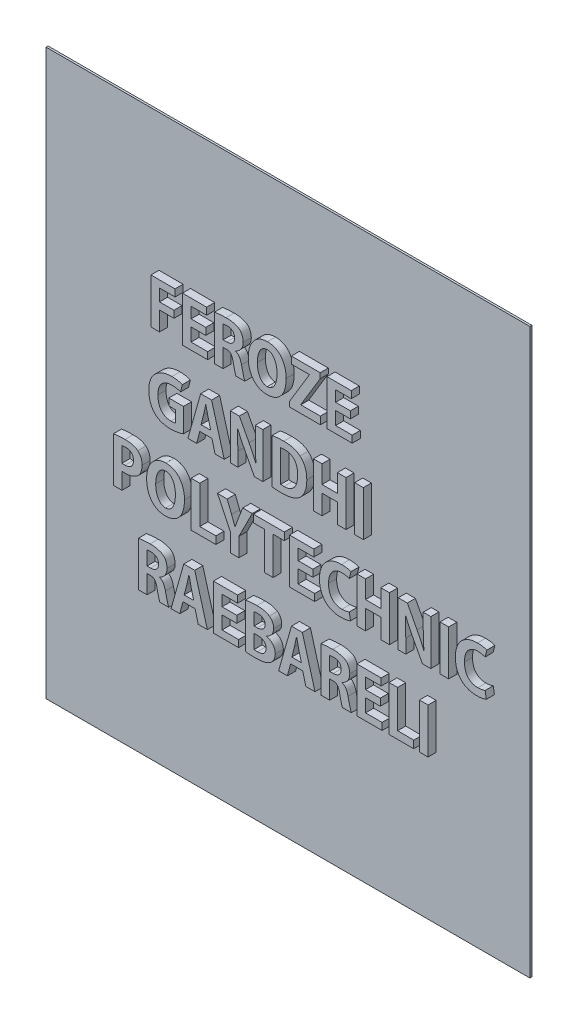
from build123d import *

# Parameters (mm, degrees)
SKETCH1_W           = 120
SKETCH1_H           = 140
BOSS_EXTRUDE1_DEPTH = 0.5
SKETCH2_W           = 2.140804471
SKETCH2_H           = 11.176
BOSS_EXTRUDE2_DEPTH = 2


with BuildPart() as part:
    # Sketch1 → Boss-Extrude1 (new body)
    with BuildSketch(Plane.XY):
        with Locations((60, 70)):
            Rectangle(SKETCH1_W, SKETCH1_H)
    extrude(amount=BOSS_EXTRUDE1_DEPTH)

    # Sketch2 → Boss-Extrude2 (add)
    # profile 1 of 32: a face of its own
    with BuildSketch(Plane.XY.offset(0.5)):
        Polygon((30.129260259, 99.595563173), (33.71210993, 99.595563173), (33.71210993, 101.3318045), (30.129260259, 101.3318045), (30.129260259, 104.315440451), (33.974269662, 104.315440451), (33.974269662, 106.051683836), (27.988455788, 106.051683836), (27.988455788, 94.875683836), (30.129260259, 94.875683836), align=None)
    # profile 2 of 32: a face of its own
    with BuildSketch(Plane.XY.offset(0.5)):
        Polygon((37.950774588, 96.611927221), (37.950774588, 99.865270563), (41.606446407, 99.865270563), (41.606446407, 101.601511891), (37.950774588, 101.601511891), (37.950774588, 104.315440451), (41.82491285, 104.315440451), (41.82491285, 106.051683836), (35.809970117, 106.051683836), (35.809970117, 94.875685894), (42.057943723, 94.875685894), (42.057943723, 96.611927221), align=None)
    # profile 3 of 32: a face of its own
    with BuildSketch(Plane.XY.offset(0.5)):
        with BuildLine():
            Line((43.766338141, 94.875683836), (45.907142612, 94.875683836))
            Line((45.907142612, 94.875683836), (45.907142612, 99.460709477))
            Line((45.907142612, 99.460709477), (46.633923697, 99.460709477))
            add(Edge.make_bspline(
                [(46.633923697, 99.460709477), (46.694424927, 99.460274922), (46.812119734, 99.459429569), (46.983400608, 99.44210956), (47.144524255, 99.413505198), (47.295228554, 99.369334388), (47.434598393, 99.309577076), (47.564562881, 99.238784517), (47.680800358, 99.150716499), (47.788437446, 99.050503098), (47.886223003, 98.931521953), (47.979625611, 98.794871689), (48.061869328, 98.634952787), (48.143715376, 98.458165165), (48.212828493, 98.258886528), (48.282001737, 98.041855828), (48.339412924, 97.802648414), (48.373633187, 97.636070148), (48.39140053, 97.549581822)],
                knots=[0, 0, 0, 0, 1.001974666, 1.949170552, 2.84847504, 3.710096242, 4.544408109, 5.357094972, 6.155407276, 6.953973995, 7.788367017, 8.701791117, 9.690949389, 10.763842173, 11.927092208, 13.182233812, 14.537000723, 16, 16, 16, 16], degree=3))
            add(Edge.make_bspline(
                [(48.39140053, 97.549581822), (48.423721078, 97.384382147), (48.485853764, 97.066804002), (48.58595699, 96.613570399), (48.678890154, 96.201131603), (48.774134922, 95.835768373), (48.860805134, 95.517646901), (48.943655977, 95.254185761), (49.011867421, 95.042790805), (49.064186843, 94.924548767), (49.086739897, 94.873578805)],
                knots=[0, 0, 0, 0, 1.458923133, 2.804618726, 4.022904405, 5.122896265, 6.077023435, 6.879967071, 7.517193397, 8, 8, 8, 8], degree=3))
            Line((49.086739897, 94.873578805), (51.289966879, 94.875683836))
            add(Edge.make_bspline(
                [(51.289966879, 94.875683836), (51.260311357, 94.943387196), (51.192043706, 95.099241792), (51.10711625, 95.373072855), (51.008542775, 95.709779014), (50.91000664, 96.104305893), (50.803439401, 96.541210469), (50.695915627, 97.006302968), (50.578134312, 97.490852742), (50.501683129, 97.821320857), (50.462669007, 97.98996342)],
                knots=[0, 0, 0, 0, 0.549570025, 1.265122049, 2.130097267, 3.160546163, 4.289861562, 5.476300611, 6.712120432, 8, 8, 8, 8], degree=3))
            add(Edge.make_bspline(
                [(50.462669007, 97.98996342), (50.429858879, 98.128273855), (50.366733971, 98.394375634), (50.238240761, 98.769213621), (50.094637051, 99.108266412), (49.928398561, 99.409630992), (49.739004688, 99.674040789), (49.516209568, 99.893631728), (49.265728476, 100.074863053), (49.07927372, 100.159756663), (48.985599625, 100.202406859)],
                knots=[0, 0, 0, 0, 1.229855108, 2.366174558, 3.425587808, 4.413573034, 5.340237738, 6.230192189, 7.110855911, 8, 8, 8, 8], degree=3))
            Line((48.985599625, 100.202406859), (48.987373366, 100.246855325))
            add(Edge.make_bspline(
                [(48.987373366, 100.246855325), (49.117391787, 100.303254913), (49.376864318, 100.415809302), (49.729820668, 100.655865026), (50.053868439, 100.940620545), (50.293394119, 101.217416241), (50.461219019, 101.463257566), (50.572839827, 101.659012449), (50.668604869, 101.864606502), (50.745967314, 102.080783344), (50.809881299, 102.306564685), (50.855681905, 102.54338961), (50.885791693, 102.789874419), (50.891651644, 102.957690967), (50.89462225, 103.042762817)],
                knots=[0, 0, 0, 0, 1.415251057, 2.824359598, 4.248283838, 5.723142377, 6.47158846, 7.223785845, 7.975195039, 8.737661918, 9.518558112, 10.320635523, 11.148673685, 12, 12, 12, 12], degree=3))
            add(Edge.make_bspline(
                [(50.89462225, 103.042762817), (50.888649382, 103.129960809), (50.876911626, 103.301320514), (50.841872067, 103.550644371), (50.800347048, 103.788508391), (50.748352469, 104.013144198), (50.684538919, 104.225517015), (50.611238396, 104.425615985), (50.527556892, 104.613352819), (50.431662013, 104.787674596), (50.326267701, 104.949241684), (50.213491282, 105.101054327), (50.08478863, 105.234879714), (49.950426492, 105.361497993), (49.802324173, 105.471849403), (49.645343207, 105.572661934), (49.476888724, 105.658233591), (49.241607881, 105.75465603), (48.943092258, 105.853389804), (48.591613136, 105.963682967), (48.245381454, 106.046381846), (47.90988985, 106.11578284), (47.581716962, 106.160616484), (47.262722353, 106.192905122), (46.951415298, 106.198193499), (46.747136149, 106.188967281), (46.646730847, 106.1844325)],
                knots=[0, 0, 0, 0, 1.04254728, 2.048792541, 3.00224853, 3.923105087, 4.79804786, 5.646501919, 6.464227683, 7.248100506, 8.017504481, 8.765055913, 9.500244792, 10.229727568, 10.965537121, 11.700200404, 12.45355415, 13.216173449, 14.732128481, 16.203485081, 17.610025167, 18.977448705, 20.289434687, 21.560307215, 22.800865913, 24, 24, 24, 24], degree=3))
            add(Edge.make_bspline(
                [(46.646730847, 106.1844325), (46.37834799, 106.181277267), (45.853774749, 106.17511014), (45.209693684, 106.132794911), (44.721235907, 106.087119217), (44.382606664, 106.049455859), (44.065672887, 106.007847991), (43.862492162, 105.974905234), (43.764233109, 105.958973978)],
                knots=[0, 0, 0, 0, 1.668967631, 3.262115064, 4.012317135, 4.719957541, 5.380966089, 6, 6, 6, 6], degree=3))
            Line((43.764233109, 105.958973978), (43.766338141, 94.875683836))
        make_face()
        with BuildLine():
            add(Edge.make_bspline(
                [(45.907142612, 104.49713778), (45.960305701, 104.510765043), (46.084858849, 104.542691677), (46.304931646, 104.56512015), (46.581098345, 104.582600489), (46.784341455, 104.582887877), (46.895367348, 104.583044868)],
                knots=[0, 0, 0, 0, 0.661277559, 1.549274193, 2.661238647, 4, 4, 4, 4], degree=3))
            add(Edge.make_bspline(
                [(46.895367348, 104.583044868), (46.999560632, 104.583639593), (47.208935957, 104.584834687), (47.520898871, 104.524318127), (47.827527078, 104.419069149), (48.075831328, 104.296648928), (48.261882035, 104.167407872), (48.38599636, 104.045092036), (48.491097545, 103.899967929), (48.581652824, 103.733436826), (48.648011575, 103.542673898), (48.704557534, 103.332536206), (48.739200967, 103.099253488), (48.748808826, 102.936107212), (48.753819836, 102.851017719)],
                knots=[0, 0, 0, 0, 1.292083092, 2.596427594, 3.923894466, 5.313341569, 6.020452472, 6.730143688, 7.466744382, 8.239869291, 9.076443159, 9.969725277, 10.941103348, 12, 12, 12, 12], degree=3))
            add(Edge.make_bspline(
                [(48.753819836, 102.851017719), (48.751437356, 102.784911057), (48.746781923, 102.655736833), (48.720953762, 102.467503531), (48.681274415, 102.288780838), (48.625088638, 102.12017474), (48.549836123, 101.962347079), (48.459954761, 101.814967997), (48.352518598, 101.679154122), (48.233144238, 101.552181683), (48.097922194, 101.438707959), (47.950175417, 101.338645768), (47.787366087, 101.256538083), (47.613225711, 101.187337758), (47.425692685, 101.131944179), (47.226018179, 101.092966566), (47.013322978, 101.066862919), (46.867352489, 101.062328893), (46.792119987, 101.059992078)],
                knots=[0, 0, 0, 0, 1.059346065, 2.069991167, 3.039184971, 3.989375718, 4.910601955, 5.835121727, 6.749101981, 7.680445877, 8.622807178, 9.571664136, 10.532985652, 11.538164881, 12.57081342, 13.661090204, 14.794536924, 16, 16, 16, 16], degree=3))
            Line((46.792119987, 101.059992078), (45.907142612, 101.062097109))
            Line((45.907142612, 101.062097109), (45.907142612, 104.49713778))
        make_face(mode=Mode.SUBTRACT)
    # profile 4 of 32: a face of its own
    with BuildSketch(Plane.XY.offset(0.5)):
        with BuildLine():
            add(Edge.make_bspline(
                [(56.918826709, 106.186537532), (56.737972451, 106.177434543), (56.384249881, 106.159630526), (55.870312591, 106.073824315), (55.385990826, 105.943905581), (54.931213995, 105.764441057), (54.50781839, 105.532693519), (54.113597809, 105.254721885), (53.747610212, 104.930610802), (53.41941137, 104.556151648), (53.122317867, 104.145575301), (52.862489215, 103.70178353), (52.643198156, 103.227112131), (52.461991178, 102.72359519), (52.318085055, 102.190271399), (52.216190093, 101.626382427), (52.152243734, 101.032632675), (52.141292914, 100.626796393), (52.135697665, 100.419437025)],
                knots=[0, 0, 0, 0, 1.033979396, 2.022301571, 2.970529521, 3.894611869, 4.808705929, 5.721706953, 6.645545269, 7.595046225, 8.560760165, 9.537443814, 10.528556773, 11.544132656, 12.591621816, 13.681030908, 14.81513806, 16, 16, 16, 16], degree=3))
            add(Edge.make_bspline(
                [(52.135697665, 100.419437025), (52.139828515, 100.217701701), (52.147921238, 99.822483291), (52.208739139, 99.244561528), (52.302058731, 98.694188716), (52.434795196, 98.17185412), (52.605372714, 97.677728292), (52.812687574, 97.211742886), (53.055543648, 96.773107296), (53.334730421, 96.365312242), (53.647026169, 95.992674908), (53.997136752, 95.667358273), (54.381415424, 95.392933864), (54.795439038, 95.162170608), (55.244157921, 94.983309222), (55.724557991, 94.850977869), (56.237382777, 94.765142807), (56.590449571, 94.749066581), (56.771293441, 94.740832199)],
                knots=[0, 0, 0, 0, 1.175398352, 2.302715549, 3.382711972, 4.426044826, 5.439559783, 6.425314094, 7.394529886, 8.35725084, 9.301097905, 10.222100453, 11.134210928, 12.046578501, 12.977639436, 13.941864418, 14.945805126, 16, 16, 16, 16], degree=3))
            add(Edge.make_bspline(
                [(56.771293441, 94.740832199), (56.944319167, 94.745091733), (57.284088815, 94.753456158), (57.779555561, 94.824723605), (58.250058023, 94.938211528), (58.69448494, 95.098095589), (59.11290133, 95.307232342), (59.506817746, 95.559551634), (59.870436517, 95.863589013), (60.211664323, 96.206080371), (60.517884456, 96.597422745), (60.784291006, 97.035725016), (61.01237729, 97.518736841), (61.198427365, 98.047274998), (61.345991587, 98.619741598), (61.451821137, 99.237090216), (61.519274291, 99.899664881), (61.532713303, 100.35676377), (61.539635824, 100.592218322)],
                knots=[0, 0, 0, 0, 0.973215927, 1.911098665, 2.810233662, 3.692878859, 4.562482505, 5.437306462, 6.318818337, 7.224297875, 8.153278156, 9.107653746, 10.104740014, 11.153537043, 12.255914066, 13.4274303, 14.674852943, 16, 16, 16, 16], degree=3))
            add(Edge.make_bspline(
                [(61.539635824, 100.592218322), (61.536903972, 100.780600774), (61.531530059, 101.151173882), (61.474167185, 101.69522757), (61.386966188, 102.217960291), (61.263017143, 102.719360686), (61.100095504, 103.199036958), (60.901747718, 103.656922366), (60.669135553, 104.094008101), (60.400930458, 104.50577639), (60.098138156, 104.886227505), (59.753843475, 105.220410323), (59.371316885, 105.505081994), (58.950960836, 105.740002247), (58.493991056, 105.925291366), (58.001910283, 106.065197743), (57.472362837, 106.153327053), (57.106645455, 106.173876826), (56.918789671, 106.1844325)],
                knots=[0, 0, 0, 0, 1.108815589, 2.181186377, 3.217324289, 4.227359111, 5.218662007, 6.196651342, 7.162419235, 8.130521869, 9.086401898, 10.019355721, 10.947374437, 11.886103195, 12.846837522, 13.844349182, 14.892720183, 16, 16, 16, 16], degree=3))
            Line((56.918789671, 106.1844325), (56.918826709, 106.186537532))
        make_face()
        with BuildLine():
            add(Edge.make_bspline(
                [(56.860445529, 104.450294147), (56.960249244, 104.441244188), (57.154800627, 104.423602742), (57.436063108, 104.361014072), (57.696990147, 104.260282616), (57.937537168, 104.125391814), (58.158417086, 103.955324187), (58.359004244, 103.751973269), (58.538958057, 103.513635124), (58.695140534, 103.243187746), (58.830915873, 102.949634209), (58.955361145, 102.64188624), (59.054482871, 102.318306145), (59.139995096, 101.982486996), (59.204607236, 101.632580623), (59.250774004, 101.268908701), (59.27871435, 100.891869026), (59.281519502, 100.635812775), (59.282943517, 100.505827674)],
                knots=[0, 0, 0, 0, 0.936463798, 1.82548641, 2.684127786, 3.542744044, 4.395260201, 5.282267079, 6.205678022, 7.180000722, 8.196506421, 9.228258241, 10.281381103, 11.358157126, 12.467215955, 13.606035564, 14.784721301, 16, 16, 16, 16], degree=3))
            add(Edge.make_bspline(
                [(59.282943517, 100.505827674), (59.280847443, 100.365301117), (59.276734427, 100.089553155), (59.24665213, 99.685168409), (59.199143007, 99.299583027), (59.131156138, 98.932384055), (59.045747708, 98.583782601), (58.94105139, 98.252888381), (58.812788646, 97.94284261), (58.672480733, 97.65060954), (58.511417053, 97.38440663), (58.329378085, 97.150626447), (58.128823411, 96.949782744), (57.906563523, 96.787035224), (57.669211156, 96.653344906), (57.41073725, 96.559195303), (57.134448885, 96.496325397), (56.943010361, 96.483590578), (56.845041556, 96.477073526)],
                knots=[0, 0, 0, 0, 1.289934008, 2.531170484, 3.720374072, 4.854740059, 5.957213729, 7.013449117, 8.037165448, 9.034886746, 9.986980833, 10.887254569, 11.74895182, 12.583294381, 13.408695019, 14.241067112, 15.099864807, 16, 16, 16, 16], degree=3))
            add(Edge.make_bspline(
                [(56.845041556, 96.477073526), (56.747800892, 96.483650508), (56.557803402, 96.496501202), (56.282317633, 96.558721923), (56.026327872, 96.656612965), (55.786174176, 96.786010222), (55.566899394, 96.953013697), (55.361979998, 97.15021808), (55.178622898, 97.384387071), (55.016584463, 97.650664537), (54.869914727, 97.939503343), (54.743373764, 98.249159076), (54.63674271, 98.575434722), (54.54766996, 98.918780226), (54.478683625, 99.279891662), (54.428258717, 99.658306043), (54.398673197, 100.054438449), (54.394515239, 100.323865785), (54.392389972, 100.461578805)],
                knots=[0, 0, 0, 0, 0.900670226, 1.759809896, 2.600946146, 3.429642157, 4.274359804, 5.142859609, 6.05415538, 7.017062466, 8.022526562, 9.048195907, 10.108477395, 11.19592731, 12.327557226, 13.507517, 14.726011367, 16, 16, 16, 16], degree=3))
            add(Edge.make_bspline(
                [(54.392389972, 100.461578805), (54.393788853, 100.592268391), (54.396537202, 100.849031241), (54.424724411, 101.22744365), (54.470598622, 101.592571991), (54.535898522, 101.945088982), (54.619710048, 102.284442947), (54.723320729, 102.610284555), (54.845745821, 102.922855653), (54.985343731, 103.220181695), (55.141770016, 103.497126059), (55.326500814, 103.738402314), (55.530441034, 103.946088242), (55.755991979, 104.118525202), (56.001998614, 104.256624277), (56.269442122, 104.358924797), (56.557683457, 104.424484761), (56.757620141, 104.440173805), (56.859791179, 104.448191173)],
                knots=[0, 0, 0, 0, 1.205088424, 2.367609753, 3.497237102, 4.597454418, 5.672031744, 6.718840175, 7.748493441, 8.765539111, 9.746550106, 10.675452162, 11.559455099, 12.42358487, 13.284893858, 14.152222325, 15.055754259, 16, 16, 16, 16], degree=3))
            Line((56.859791179, 104.448191173), (56.860445529, 104.450294147))
        make_face(mode=Mode.SUBTRACT)
    # profile 5 of 32: a face of its own
    with BuildSketch(Plane.XY.offset(0.5)):
        Polygon((62.82646429, 106.051683836), (62.82646429, 104.315440451), (67.305324746, 104.315440451), (67.305324746, 104.257540774), (62.388790629, 96.116991772), (62.388790629, 94.879109914), (70.033309483, 94.879109914), (70.033309483, 96.743356897), (65.175312933, 96.743356897), (65.175312933, 96.801606384), (69.989723195, 104.763526094), (69.989723195, 106.051683836), align=None)
    # profile 6 of 32: a face of its own
    with BuildSketch(Plane.XY.offset(0.5)):
        Polygon((73.821857544, 96.611927221), (73.821857544, 99.865270563), (77.477529363, 99.865270563), (77.477529363, 101.601511891), (73.821857544, 101.601511891), (73.821857544, 104.315440451), (77.695995806, 104.315440451), (77.695995806, 106.051683836), (71.681053073, 106.051683836), (71.681053073, 94.875685894), (77.929026679, 94.875685894), (77.929026679, 96.611927221), align=None)
    # profile 7 of 32: a face of its own
    with BuildSketch(Plane.XY.offset(0.5)):
        with BuildLine():
            Line((32.439932318, 81.844205707), (32.439932318, 80.133249447))
            Line((32.439932318, 80.133249447), (34.05687002, 80.133249447))
            Line((34.05687002, 80.133249447), (34.05687002, 77.302589391))
            add(Edge.make_bspline(
                [(34.05687002, 77.302589391), (34.029086727, 77.289403437), (33.970124069, 77.261419752), (33.868491769, 77.234300258), (33.75356041, 77.206236977), (33.622541944, 77.18395071), (33.476473605, 77.164155591), (33.314533845, 77.153517308), (33.136915932, 77.141788436), (33.013184785, 77.13862408), (32.948545327, 77.136970962)],
                knots=[0, 0, 0, 0, 0.653154628, 1.386147199, 2.230860804, 3.172021168, 4.212071664, 5.366447579, 6.624183111, 8, 8, 8, 8], degree=3))
            add(Edge.make_bspline(
                [(32.948545327, 77.136970962), (32.833159551, 77.13930273), (32.606235533, 77.143888514), (32.275463112, 77.194805897), (31.959608825, 77.271235001), (31.661774089, 77.385104767), (31.377765653, 77.525087092), (31.112360985, 77.700752372), (30.862700907, 77.905850246), (30.630505224, 78.142690123), (30.418893141, 78.409601359), (30.237468643, 78.710752655), (30.080689171, 79.04083344), (29.953930152, 79.403030558), (29.849489037, 79.793647333), (29.778275725, 80.215602242), (29.728275167, 80.667310637), (29.718965195, 80.979456082), (29.714163728, 81.140440042)],
                knots=[0, 0, 0, 0, 0.953676512, 1.87555272, 2.761867879, 3.637011316, 4.507417159, 5.37595959, 6.263416516, 7.1754643, 8.114589267, 9.074123104, 10.077253866, 11.132050585, 12.243927563, 13.417825685, 14.668285404, 16, 16, 16, 16], degree=3))
            add(Edge.make_bspline(
                [(29.714163728, 81.140440042), (29.719587571, 81.300027884), (29.730105975, 81.609514953), (29.783145234, 82.056849205), (29.864349265, 82.472197825), (29.975400539, 82.853907303), (30.114526582, 83.204424747), (30.285642447, 83.520676172), (30.483762268, 83.807429808), (30.716382127, 84.055876547), (30.969580496, 84.27476701), (31.239871588, 84.46613845), (31.529680405, 84.624782515), (31.835205618, 84.755412667), (32.158352046, 84.85752809), (32.498593587, 84.928193042), (32.856106537, 84.971503377), (33.100130129, 84.975441024), (33.224573984, 84.977449092)],
                knots=[0, 0, 0, 0, 1.298542789, 2.518250729, 3.66010011, 4.737713637, 5.747803493, 6.721842567, 7.65708385, 8.574936643, 9.482253959, 10.376304947, 11.263703582, 12.164756428, 13.075521448, 14.015723889, 14.988085666, 16, 16, 16, 16], degree=3))
            add(Edge.make_bspline(
                [(33.224573984, 84.977449092), (33.341891181, 84.975553135), (33.567589858, 84.971905633), (33.891971617, 84.95206355), (34.18774764, 84.915217387), (34.457715134, 84.870665781), (34.703472924, 84.808931744), (34.931760213, 84.74594598), (35.140905515, 84.669396512), (35.272244305, 84.611482458), (35.335877152, 84.583423451)],
                knots=[0, 0, 0, 0, 1.300829087, 2.50257772, 3.600788493, 4.604486954, 5.533740486, 6.408714025, 7.229031605, 8, 8, 8, 8], degree=3))
            Line((35.335877152, 84.583423451), (35.778332916, 86.369481794))
            add(Edge.make_bspline(
                [(35.778332916, 86.369481794), (35.705649849, 86.402155639), (35.552503018, 86.471001054), (35.302883337, 86.562685483), (35.018510412, 86.637686828), (34.704862521, 86.710001033), (34.362400471, 86.768600382), (33.99519458, 86.810102496), (33.604190108, 86.835152739), (33.335584389, 86.839818667), (33.197181827, 86.842222847)],
                knots=[0, 0, 0, 0, 0.723254479, 1.523933104, 2.410192463, 3.390746967, 4.445142521, 5.561749782, 6.743660119, 8, 8, 8, 8], degree=3))
            add(Edge.make_bspline(
                [(33.197181827, 86.842222847), (32.995385553, 86.837254629), (32.59962551, 86.82751103), (32.020046624, 86.754306351), (31.468024483, 86.636632677), (30.942160857, 86.474098), (30.443162139, 86.265936238), (29.97285168, 86.008247911), (29.528176626, 85.708257145), (29.182404794, 85.421221621), (28.92424126, 85.168781937), (28.741457278, 84.968930502), (28.569060934, 84.759665319), (28.412095521, 84.538410468), (28.266074237, 84.307553088), (28.130887357, 84.067443244), (28.008460615, 83.816253302), (27.899612098, 83.554000962), (27.799221793, 83.282727603), (27.716583352, 82.999723354), (27.642526822, 82.708124347), (27.57815656, 82.406945039), (27.531370671, 82.094273484), (27.492762408, 81.771846011), (27.467251948, 81.438609831), (27.46076291, 81.212825025), (27.45747142, 81.098298262)],
                knots=[0, 0, 0, 0, 1.588252423, 3.114858529, 4.590810091, 6.026612173, 7.441653233, 8.839609889, 10.241268389, 11.658554554, 12.370162762, 13.082415096, 13.78967092, 14.503124065, 15.216405789, 15.939266766, 16.671226771, 17.414686674, 18.173812935, 18.947024519, 19.734205331, 20.542085796, 21.370222467, 22.222016626, 23.098138246, 24, 24, 24, 24], degree=3))
            add(Edge.make_bspline(
                [(27.45747142, 81.098298262), (27.463225681, 80.874757094), (27.474494627, 80.436981803), (27.548250307, 79.795934665), (27.673356365, 79.186587523), (27.815679142, 78.700908308), (27.953141511, 78.331582653), (28.067920997, 78.068915499), (28.191731975, 77.81822717), (28.32643412, 77.579484829), (28.473126298, 77.354217032), (28.625294303, 77.137916774), (28.793191879, 76.937222753), (28.912781631, 76.811843084), (28.972468404, 76.749266588)],
                knots=[0, 0, 0, 0, 1.704842656, 3.338704885, 4.913464543, 6.443981355, 7.193187298, 7.917665265, 8.629154765, 9.324799911, 10.00680261, 10.678695983, 11.34054239, 12, 12, 12, 12], degree=3))
            add(Edge.make_bspline(
                [(28.972468404, 76.749266588), (29.092855338, 76.639393679), (29.333960366, 76.419345624), (29.743599766, 76.143875858), (30.186878963, 75.910891425), (30.665439094, 75.721639512), (31.179115432, 75.573717147), (31.727814672, 75.469749933), (32.312144658, 75.407387426), (32.713094233, 75.402988954), (32.919046081, 75.400729635)],
                knots=[0, 0, 0, 0, 0.913036649, 1.828584863, 2.758893342, 3.717094375, 4.709404796, 5.752305212, 6.845448596, 8, 8, 8, 8], degree=3))
            add(Edge.make_bspline(
                [(32.919046081, 75.400729635), (33.077853332, 75.404033483), (33.390237755, 75.410532373), (33.849987647, 75.447749695), (34.293713814, 75.501861531), (34.716727033, 75.575168358), (35.110577961, 75.661032847), (35.466105316, 75.75121738), (35.779568651, 75.842276662), (35.971121083, 75.911827589), (36.060715764, 75.944358594)],
                knots=[0, 0, 0, 0, 1.189863118, 2.340539873, 3.45407261, 4.538092694, 5.555811396, 6.473485662, 7.286004554, 8, 8, 8, 8], degree=3))
            Line((36.060715764, 75.944358594), (36.062820795, 81.844205707))
            Line((36.062820795, 81.844205707), (32.439932318, 81.844205707))
        make_face()
    # profile 8 of 32: a face of its own
    with BuildSketch(Plane.XY.offset(0.5)):
        Polygon((40.335032203, 86.711581272), (37.159986559, 75.535581272), (39.344650993, 75.535581272), (40.116565759, 78.502362569), (43.116838248, 78.502362569), (43.917881874, 75.535581272), (46.175368455, 75.535581272), (43.0440161, 86.711581272), align=None)
        with BuildLine():
            add(Edge.make_bspline(
                [(41.09238254, 82.665281082), (41.134298306, 82.848024859), (41.221672778, 83.228958878), (41.345872512, 83.811958938), (41.469671819, 84.398254734), (41.547854376, 84.786348714), (41.585503094, 84.973234914)],
                knots=[0, 0, 0, 0, 0.953270338, 1.987116089, 3.030698116, 4, 4, 4, 4], degree=3))
            Line((41.585503094, 84.973234914), (41.631266433, 84.975337887))
            add(Edge.make_bspline(
                [(41.631266433, 84.975337887), (41.670132044, 84.791328158), (41.750987393, 84.408517481), (41.87317266, 83.826310061), (42.002617272, 83.241619028), (42.0948888, 82.856891911), (42.139667499, 82.670186648)],
                knots=[0, 0, 0, 0, 0.95601635, 1.988879968, 3.024018124, 4, 4, 4, 4], degree=3))
            Line((42.139667499, 82.670186648), (42.810985228, 80.103752259))
            Line((42.810985228, 80.103752259), (40.42241878, 80.103752259))
            Line((40.42241878, 80.103752259), (41.09238254, 82.665281082))
        make_face(mode=Mode.SUBTRACT)
    # profile 9 of 32: a face of its own
    with BuildSketch(Plane.XY.offset(0.5)):
        with BuildLine():
            Line((53.880363232, 86.711581272), (53.880363232, 83.354638702))
            add(Edge.make_bspline(
                [(53.880363232, 83.354638702), (53.879729949, 83.131402222), (53.878482924, 82.691817433), (53.887550644, 82.042206527), (53.90299161, 81.412206062), (53.920285186, 80.800303923), (53.949000242, 80.206173986), (53.9804821, 79.63022459), (54.014676404, 79.072279381), (54.04609788, 78.707399831), (54.061577001, 78.527649695)],
                knots=[0, 0, 0, 0, 1.108785729, 2.183358836, 3.226729933, 4.238905081, 5.223729294, 6.181031371, 7.103923864, 8, 8, 8, 8], degree=3))
            Line((54.061577001, 78.527649695), (54.033962612, 78.529495455))
            add(Edge.make_bspline(
                [(54.033962612, 78.529495455), (53.912377034, 78.831023254), (53.662738429, 79.450117887), (53.246959129, 80.37236851), (52.807585118, 81.289632054), (52.490999249, 81.885265467), (52.335871119, 82.177127825)],
                knots=[0, 0, 0, 0, 0.969008475, 1.98956099, 3.014878184, 4, 4, 4, 4], degree=3))
            Line((52.335871119, 82.177127825), (49.933929594, 86.711581272))
            Line((49.933929594, 86.711581272), (47.677095305, 86.711581272))
            Line((47.677095305, 86.711581272), (47.677095305, 75.535581272))
            Line((47.677095305, 75.535581272), (49.548192385, 75.535581272))
            Line((49.548192385, 75.535581272), (49.548192385, 78.965502375))
            add(Edge.make_bspline(
                [(49.548192385, 78.965502375), (49.547885847, 79.206556193), (49.547286334, 79.677996312), (49.539762343, 80.36784557), (49.533331395, 81.024626128), (49.516652203, 81.648969605), (49.501816929, 82.245401235), (49.476874132, 82.816323622), (49.453006701, 83.364281988), (49.432030959, 83.721646011), (49.421767046, 83.89651244)],
                knots=[0, 0, 0, 0, 1.172672213, 2.293449375, 3.35618092, 4.367854441, 5.331796788, 6.258528509, 7.147857976, 8, 8, 8, 8], degree=3))
            Line((49.421767046, 83.89651244), (49.47839712, 83.898576317))
            add(Edge.make_bspline(
                [(49.47839712, 83.898576317), (49.604664217, 83.584337224), (49.861980706, 82.94395741), (50.294607754, 81.996176512), (50.748555885, 81.060697819), (51.067348758, 80.450683749), (51.223328132, 80.152215306)],
                knots=[0, 0, 0, 0, 0.9826997, 2.002618589, 3.022718738, 4, 4, 4, 4], degree=3))
            Line((51.223328132, 80.152215306), (53.672613312, 75.535581272))
            Line((53.672613312, 75.535581272), (55.751460313, 75.535581272))
            Line((55.751460313, 75.535581272), (55.751460313, 86.709511222))
            Line((55.751460313, 86.709511222), (53.880363232, 86.711581272))
        make_face()
    # profile 10 of 32: a face of its own
    with BuildSketch(Plane.XY.offset(0.5)):
        with BuildLine():
            add(Edge.make_bspline(
                [(58.060829845, 75.55519325), (58.135937418, 75.544785066), (58.294330873, 75.522835371), (58.54306667, 75.496007266), (58.814330202, 75.473446301), (59.107163634, 75.451806814), (59.421903429, 75.435526844), (59.758365475, 75.422736057), (60.115924324, 75.414974371), (60.361771299, 75.411133278), (60.488198419, 75.409157991)],
                knots=[0, 0, 0, 0, 0.747798485, 1.577023202, 2.466955376, 3.432305679, 4.472841868, 5.575028817, 6.752955478, 8, 8, 8, 8], degree=3))
            add(Edge.make_bspline(
                [(60.488198419, 75.409157991), (60.723640392, 75.412988886), (61.182769545, 75.420459414), (61.850970877, 75.484581437), (62.480473862, 75.588245301), (63.068426363, 75.737390607), (63.615334754, 75.927190046), (64.114883592, 76.165608415), (64.574041872, 76.440199702), (64.842024875, 76.665529026), (64.974190877, 76.776658745)],
                knots=[0, 0, 0, 0, 1.17842423, 2.298013867, 3.356996017, 4.369259479, 5.331192529, 6.249700563, 7.136773321, 8, 8, 8, 8], degree=3))
            add(Edge.make_bspline(
                [(64.974190877, 76.776658745), (65.029543803, 76.826619139), (65.142059751, 76.928173684), (65.303414301, 77.095104729), (65.455359389, 77.281794394), (65.607400442, 77.48113223), (65.745804347, 77.702514476), (65.887281839, 77.935804826), (66.018098318, 78.188707035), (66.145995892, 78.457655311), (66.265388979, 78.745403729), (66.364466367, 79.056975295), (66.454532284, 79.387570962), (66.523835729, 79.740739377), (66.584707822, 80.114306741), (66.623978488, 80.509873326), (66.655875044, 80.926434214), (66.661295338, 81.211312178), (66.664076247, 81.357470208)],
                knots=[0, 0, 0, 0, 0.711529635, 1.446327024, 2.212730038, 3.007707617, 3.836959069, 4.702581573, 5.611055214, 6.552559085, 7.54462654, 8.581167827, 9.670545423, 10.812911411, 12.014096724, 13.281372547, 14.605194915, 16, 16, 16, 16], degree=3))
            add(Edge.make_bspline(
                [(66.664076247, 81.357470208), (66.662169351, 81.481813621), (66.658439029, 81.725057707), (66.63767871, 82.082976265), (66.601190006, 82.426582902), (66.554317971, 82.756715694), (66.490051159, 83.07217217), (66.414703323, 83.373271766), (66.326897753, 83.660825222), (66.222877323, 83.933391685), (66.106634302, 84.19252401), (65.980707401, 84.440212065), (65.841006426, 84.673894332), (65.69151159, 84.896272253), (65.529627287, 85.104740368), (65.355013103, 85.298945431), (65.172685833, 85.484117911), (65.040408167, 85.595806853), (64.974190877, 85.651717568)],
                knots=[0, 0, 0, 0, 1.250196122, 2.445668869, 3.60292861, 4.723409941, 5.796680955, 6.837975795, 7.843086112, 8.817515314, 9.76895262, 10.69744629, 11.609358382, 12.504409608, 13.39005195, 14.260302496, 15.129119398, 16, 16, 16, 16], degree=3))
            add(Edge.make_bspline(
                [(64.974190877, 85.651717568), (64.855372839, 85.746501818), (64.615256403, 85.938048965), (64.212658927, 86.177880231), (63.774124008, 86.379628076), (63.297761232, 86.548014631), (62.77802725, 86.674735599), (62.211769718, 86.767262751), (61.59686608, 86.82104306), (61.170300052, 86.828058524), (60.949650907, 86.831687402)],
                knots=[0, 0, 0, 0, 0.850789701, 1.719339872, 2.61723906, 3.551911928, 4.545442216, 5.610282156, 6.763874371, 8, 8, 8, 8], degree=3))
            add(Edge.make_bspline(
                [(60.949650907, 86.831687402), (60.683374493, 86.82928519), (60.163741978, 86.824597327), (59.52460272, 86.783426031), (59.037904467, 86.739730829), (58.696122794, 86.695953287), (58.371192075, 86.651253146), (58.161165773, 86.613908432), (58.058724814, 86.595693435)],
                knots=[0, 0, 0, 0, 1.650018419, 3.219974348, 3.967566001, 4.678084243, 5.355231624, 6, 6, 6, 6], degree=3))
            Line((58.058724814, 86.595693435), (58.060829845, 75.55519325))
        make_face()
        with BuildLine():
            add(Edge.make_bspline(
                [(60.201634316, 85.03545577), (60.26543065, 85.047144187), (60.405703633, 85.072844241), (60.638169094, 85.095392126), (60.909985518, 85.115739627), (61.104822328, 85.118994009), (61.208822853, 85.120731143)],
                knots=[0, 0, 0, 0, 0.76869223, 1.690171609, 2.76705349, 4, 4, 4, 4], degree=3))
            add(Edge.make_bspline(
                [(61.208822853, 85.120731143), (61.330462102, 85.118027762), (61.567562186, 85.112758313), (61.912749423, 85.068080536), (62.236797995, 84.993368868), (62.542824794, 84.895170655), (62.824508605, 84.756107846), (63.089655235, 84.595847965), (63.331461916, 84.40076385), (63.553857884, 84.179320477), (63.753268928, 83.926584795), (63.926601706, 83.642940681), (64.070159045, 83.328436916), (64.195548764, 82.987140386), (64.284066229, 82.613111686), (64.355027036, 82.211628437), (64.396443664, 81.779727674), (64.403656861, 81.481873179), (64.407383939, 81.327970962)],
                knots=[0, 0, 0, 0, 1.034636826, 2.016721417, 2.954616098, 3.861659027, 4.743652532, 5.62095741, 6.492606741, 7.379948462, 8.28614458, 9.224914536, 10.200706863, 11.223314941, 12.31319917, 13.465574242, 14.690455408, 16, 16, 16, 16], degree=3))
            add(Edge.make_bspline(
                [(64.407383939, 81.327970962), (64.40315042, 81.150879545), (64.394970955, 80.808726163), (64.349162384, 80.313651137), (64.273160551, 79.856265295), (64.173961914, 79.43394868), (64.043434267, 79.049376329), (63.88572859, 78.700198154), (63.697863817, 78.389220467), (63.48321799, 78.114198859), (63.244148143, 77.875827), (62.985110452, 77.669970475), (62.70748991, 77.495004159), (62.407586325, 77.355724692), (62.088651103, 77.248784231), (61.750690007, 77.172164472), (61.392540429, 77.129959858), (61.147123877, 77.127630066), (61.021291933, 77.126435517)],
                knots=[0, 0, 0, 0, 1.382790342, 2.671650606, 3.877892401, 5.000458499, 6.054825918, 7.043745429, 7.986092149, 8.88452668, 9.760866288, 10.615577842, 11.46308158, 12.316807429, 13.190810493, 14.084799087, 15.018022824, 16, 16, 16, 16], degree=3))
            add(Edge.make_bspline(
                [(61.021291933, 77.126435517), (60.946127291, 77.124830203), (60.800662214, 77.121723462), (60.589177663, 77.13196618), (60.390720919, 77.144841544), (60.263369461, 77.162246921), (60.201634316, 77.170684386)],
                knots=[0, 0, 0, 0, 1.0974001, 2.123783006, 3.090481336, 4, 4, 4, 4], degree=3))
            Line((60.201634316, 77.170684386), (60.201634316, 85.03545577))
        make_face(mode=Mode.SUBTRACT)
    # profile 11 of 32: a face of its own
    with BuildSketch(Plane.XY.offset(0.5)):
        Polygon((74.243271226, 86.711581272), (74.243271226, 82.257985307), (70.450515161, 82.257985307), (70.450515161, 86.711581272), (68.30971069, 86.711581272), (68.30971069, 75.535581272), (70.450515161, 75.535581272), (70.450515161, 80.393738323), (74.243271226, 80.393738323), (74.243271226, 75.535581272), (76.384075697, 75.535581272), (76.384075697, 86.711581272), align=None)
    # profile 12 of 32: a face of its own
    with BuildSketch(Plane.XY.offset(0.5)):
        with Locations((79.628993769, 81.123581272)):
            Rectangle(SKETCH2_W, SKETCH2_H)
    # profile 13 of 32: a face of its own
    with BuildSketch(Plane.XY.offset(0.5)):
        with BuildLine():
            Line((20.824355281, 56.195478708), (20.824355281, 60.312730593))
            add(Edge.make_bspline(
                [(20.824355281, 60.312730593), (20.880390689, 60.301743271), (20.998079999, 60.278666961), (21.184613615, 60.266525459), (21.386688807, 60.250574312), (21.526673898, 60.251265948), (21.59976403, 60.25162707)],
                knots=[0, 0, 0, 0, 0.878556077, 1.845202224, 2.874919808, 4, 4, 4, 4], degree=3))
            add(Edge.make_bspline(
                [(21.59976403, 60.25162707), (21.712174175, 60.24990739), (21.938010785, 60.246452482), (22.277730561, 60.272624061), (22.618571916, 60.325820567), (22.959741323, 60.40544046), (23.3009241, 60.515457458), (23.644614531, 60.64684442), (23.987490921, 60.809299213), (24.330731663, 60.989936046), (24.658078371, 61.209533345), (24.944232303, 61.486688806), (25.194291459, 61.80746916), (25.397577861, 62.179551607), (25.565013469, 62.595952651), (25.689442781, 63.06081664), (25.776246714, 63.572369251), (25.799674322, 63.930258348), (25.811834919, 64.116028277)],
                knots=[0, 0, 0, 0, 0.833289012, 1.674111924, 2.522657586, 3.389263135, 4.268823519, 5.178937882, 6.115592007, 7.080320305, 8.053990079, 9.02646125, 10.021322704, 11.058824518, 12.159401549, 13.341997366, 14.620307338, 16, 16, 16, 16], degree=3))
            add(Edge.make_bspline(
                [(25.811834919, 64.116028277), (25.808260726, 64.24828615), (25.801251667, 64.507646304), (25.744188848, 64.886422387), (25.657485915, 65.246551701), (25.531950458, 65.58434997), (25.377624083, 65.898041302), (25.192355179, 66.182317447), (24.98255103, 66.439830993), (24.817376495, 66.583511442), (24.735112446, 66.655070509)],
                knots=[0, 0, 0, 0, 1.113652048, 2.183892415, 3.220009879, 4.22902868, 5.213388997, 6.158705993, 7.082956088, 8, 8, 8, 8], degree=3))
            add(Edge.make_bspline(
                [(24.735112446, 66.655070509), (24.641775343, 66.724728524), (24.452337614, 66.866106985), (24.133834433, 67.040582866), (23.784853152, 67.187882617), (23.403665003, 67.307236168), (22.990828531, 67.400471517), (22.545902972, 67.460659374), (22.069672757, 67.500366852), (21.741729715, 67.502912656), (21.572371873, 67.504227372)],
                knots=[0, 0, 0, 0, 0.836606025, 1.697982253, 2.603178176, 3.556730869, 4.566307281, 5.642647, 6.782605007, 8, 8, 8, 8], degree=3))
            add(Edge.make_bspline(
                [(21.572371873, 67.504227372), (21.422752678, 67.502854206), (21.131871954, 67.500184578), (20.708355558, 67.484171104), (20.310102325, 67.465277746), (19.936146141, 67.443764216), (19.587189123, 67.410975751), (19.262441984, 67.376133387), (18.962897588, 67.334895248), (18.772642084, 67.299803679), (18.681445779, 67.282983028)],
                knots=[0, 0, 0, 0, 1.236938947, 2.404782995, 3.503483269, 4.533243021, 5.501074015, 6.400729939, 7.233412341, 8, 8, 8, 8], degree=3))
            Line((18.681445779, 67.282983028), (18.68355081, 56.195478708))
            Line((18.68355081, 56.195478708), (20.824355281, 56.195478708))
        make_face()
        with BuildLine():
            add(Edge.make_bspline(
                [(20.824355281, 65.814058039), (20.877582994, 65.826207955), (20.999217443, 65.853972594), (21.207236855, 65.879063672), (21.461193794, 65.894418668), (21.645393049, 65.899881263), (21.74515317, 65.90283974)],
                knots=[0, 0, 0, 0, 0.706471148, 1.614407696, 2.707991641, 4, 4, 4, 4], degree=3))
            add(Edge.make_bspline(
                [(21.74515317, 65.90283974), (21.817532559, 65.900881308), (21.959083232, 65.897051247), (22.16585444, 65.877134614), (22.360301749, 65.838740168), (22.542528465, 65.78653044), (22.712334404, 65.718221862), (22.871807397, 65.63698083), (23.016804478, 65.535973659), (23.15301781, 65.425445302), (23.273590324, 65.297656998), (23.379869186, 65.156083654), (23.468165122, 64.999218966), (23.540603466, 64.828086497), (23.596392326, 64.642806925), (23.638943719, 64.444191801), (23.664027895, 64.23113465), (23.668643135, 64.084487777), (23.671032506, 64.008566739)],
                knots=[0, 0, 0, 0, 1.131533149, 2.212912832, 3.241989747, 4.225133605, 5.170982571, 6.098953386, 7.015425386, 7.927614013, 8.836096156, 9.753816443, 10.68787068, 11.642091277, 12.652556602, 13.707537933, 14.813161868, 16, 16, 16, 16], degree=3))
            add(Edge.make_bspline(
                [(23.671032506, 64.008566739), (23.668557796, 63.931250505), (23.663730266, 63.78042619), (23.639286123, 63.56017177), (23.595037303, 63.353497454), (23.533363378, 63.159520908), (23.455789259, 62.978803554), (23.362089202, 62.809430916), (23.250648603, 62.653641787), (23.121359877, 62.512093343), (22.977080229, 62.385242989), (22.819305324, 62.272166028), (22.644391692, 62.180927702), (22.458037106, 62.100335544), (22.25547506, 62.044221887), (22.040390719, 61.998459746), (21.811142871, 61.97143482), (21.653211379, 61.966973837), (21.572371873, 61.964690419)],
                knots=[0, 0, 0, 0, 1.118399446, 2.181712992, 3.199673759, 4.169739358, 5.120633188, 6.039078007, 6.963568237, 7.883864478, 8.804945047, 9.737711392, 10.682892463, 11.652479398, 12.668157454, 13.715931646, 14.830866759, 16, 16, 16, 16], degree=3))
            add(Edge.make_bspline(
                [(21.572371873, 61.964690419), (21.499307717, 61.964701847), (21.360114506, 61.964723618), (21.161858743, 61.975485153), (20.984956874, 61.992651775), (20.875512947, 62.013802412), (20.824355281, 62.023688911)],
                knots=[0, 0, 0, 0, 1.166081162, 2.221480295, 3.168661808, 4, 4, 4, 4], degree=3))
            Line((20.824355281, 62.023688911), (20.824355281, 65.814058039))
        make_face(mode=Mode.SUBTRACT)
    # profile 14 of 32: a face of its own
    with BuildSketch(Plane.XY.offset(0.5)):
        with BuildLine():
            add(Edge.make_bspline(
                [(31.701185684, 67.506332403), (31.520331426, 67.497229415), (31.166608855, 67.479425398), (30.652671565, 67.393619187), (30.168349801, 67.263700453), (29.713572969, 67.084235929), (29.290177364, 66.852488391), (28.895956783, 66.574516757), (28.529969187, 66.250405673), (28.201770344, 65.87594652), (27.904676841, 65.465370173), (27.644848189, 65.021578402), (27.42555713, 64.546907003), (27.244350152, 64.043390062), (27.100444029, 63.510066271), (26.998549068, 62.946177299), (26.934602708, 62.352427546), (26.923651888, 61.946591264), (26.918056639, 61.739231897)],
                knots=[0, 0, 0, 0, 1.033979396, 2.022301571, 2.970529521, 3.894611869, 4.808705929, 5.721706953, 6.645545269, 7.595046225, 8.560760165, 9.537443814, 10.528556773, 11.544132656, 12.591621816, 13.681030908, 14.81513806, 16, 16, 16, 16], degree=3))
            add(Edge.make_bspline(
                [(26.918056639, 61.739231897), (26.922187489, 61.537496573), (26.930280212, 61.142278162), (26.991098113, 60.5643564), (27.084417705, 60.013983587), (27.217154171, 59.491648992), (27.387731689, 58.997523164), (27.595046549, 58.531537758), (27.837902622, 58.092902168), (28.117089395, 57.685107114), (28.429385144, 57.31246978), (28.779495726, 56.987153145), (29.163774398, 56.712728736), (29.577798012, 56.48196548), (30.026516895, 56.303104093), (30.506916965, 56.170772741), (31.019741751, 56.084937679), (31.372808545, 56.068861453), (31.553652416, 56.06062707)],
                knots=[0, 0, 0, 0, 1.175398352, 2.302715549, 3.382711972, 4.426044826, 5.439559783, 6.425314094, 7.394529886, 8.35725084, 9.301097905, 10.222100453, 11.134210928, 12.046578501, 12.977639436, 13.941864418, 14.945805126, 16, 16, 16, 16], degree=3))
            add(Edge.make_bspline(
                [(31.553652416, 56.06062707), (31.726678141, 56.064886605), (32.066447789, 56.07325103), (32.561914536, 56.144518477), (33.032416998, 56.2580064), (33.476843914, 56.417890461), (33.895260305, 56.627027214), (34.28917672, 56.879346506), (34.652795491, 57.183383885), (34.994023297, 57.525875243), (35.30024343, 57.917217617), (35.56664998, 58.355519888), (35.794736264, 58.838531712), (35.980786339, 59.36706987), (36.128350562, 59.939536469), (36.234180112, 60.556885088), (36.301633265, 61.219459753), (36.315072278, 61.676558642), (36.321994799, 61.912013194)],
                knots=[0, 0, 0, 0, 0.973215927, 1.911098665, 2.810233662, 3.692878859, 4.562482505, 5.437306462, 6.318818337, 7.224297875, 8.153278156, 9.107653746, 10.104740014, 11.153537043, 12.255914066, 13.4274303, 14.674852943, 16, 16, 16, 16], degree=3))
            add(Edge.make_bspline(
                [(36.321994799, 61.912013194), (36.319262947, 62.100395646), (36.313889034, 62.470968753), (36.25652616, 63.015022442), (36.169325162, 63.537755163), (36.045376117, 64.039155557), (35.882454478, 64.51883183), (35.684106693, 64.976717238), (35.451494527, 65.413802972), (35.183289432, 65.825571262), (34.88049713, 66.206022376), (34.536202449, 66.540205194), (34.153675859, 66.824876866), (33.73331981, 67.059797119), (33.276350031, 67.245086238), (32.784269258, 67.384992615), (32.254721811, 67.473121925), (31.889004429, 67.493671698), (31.701148645, 67.504227372)],
                knots=[0, 0, 0, 0, 1.108815589, 2.181186377, 3.217324289, 4.227359111, 5.218662007, 6.196651342, 7.162419235, 8.130521869, 9.086401898, 10.019355721, 10.947374437, 11.886103195, 12.846837522, 13.844349182, 14.892720183, 16, 16, 16, 16], degree=3))
            Line((31.701148645, 67.504227372), (31.701185684, 67.506332403))
        make_face()
        with BuildLine():
            add(Edge.make_bspline(
                [(31.642804503, 65.770089018), (31.742608219, 65.76103906), (31.937159601, 65.743397614), (32.218422083, 65.680808943), (32.479349122, 65.580077488), (32.719896142, 65.445186686), (32.940776061, 65.275119059), (33.141363218, 65.07176814), (33.321317032, 64.833429996), (33.477499509, 64.562982618), (33.613274847, 64.269429081), (33.73772012, 63.961681112), (33.836841845, 63.638101017), (33.92235407, 63.302281867), (33.986966211, 62.952375495), (34.033132978, 62.588703573), (34.061073324, 62.211663898), (34.063878476, 61.955607646), (34.065302491, 61.825622546)],
                knots=[0, 0, 0, 0, 0.936463798, 1.82548641, 2.684127786, 3.542744044, 4.395260201, 5.282267079, 6.205678022, 7.180000722, 8.196506421, 9.228258241, 10.281381103, 11.358157126, 12.467215955, 13.606035564, 14.784721301, 16, 16, 16, 16], degree=3))
            add(Edge.make_bspline(
                [(34.065302491, 61.825622546), (34.063206418, 61.685095988), (34.059093402, 61.409348027), (34.029011105, 61.004963281), (33.981501982, 60.619377899), (33.913515113, 60.252178926), (33.828106683, 59.903577473), (33.723410364, 59.572683253), (33.59514762, 59.262637482), (33.454839707, 58.970404412), (33.293776027, 58.704201502), (33.11173706, 58.470421318), (32.911182386, 58.269577616), (32.688922498, 58.106830096), (32.45157013, 57.973139778), (32.193096224, 57.878990175), (31.916807859, 57.816120268), (31.725369335, 57.80338545), (31.62740053, 57.796868398)],
                knots=[0, 0, 0, 0, 1.289934008, 2.531170484, 3.720374072, 4.854740059, 5.957213729, 7.013449117, 8.037165448, 9.034886746, 9.986980833, 10.887254569, 11.74895182, 12.583294381, 13.408695019, 14.241067112, 15.099864807, 16, 16, 16, 16], degree=3))
            add(Edge.make_bspline(
                [(31.62740053, 57.796868398), (31.530159867, 57.80344538), (31.340162377, 57.816296074), (31.064676607, 57.878516795), (30.808686846, 57.976407836), (30.568533151, 58.105805093), (30.349258369, 58.272808569), (30.144338972, 58.470012951), (29.960981872, 58.704181943), (29.798943437, 58.970459409), (29.652273701, 59.259298214), (29.525732738, 59.568953948), (29.419101684, 59.895229593), (29.330028935, 60.238575098), (29.2610426, 60.599686534), (29.210617691, 60.978100915), (29.181032172, 61.374233321), (29.176874213, 61.643660656), (29.174748947, 61.781373677)],
                knots=[0, 0, 0, 0, 0.900670226, 1.759809896, 2.600946146, 3.429642157, 4.274359804, 5.142859609, 6.05415538, 7.017062466, 8.022526562, 9.048195907, 10.108477395, 11.19592731, 12.327557226, 13.507517, 14.726011367, 16, 16, 16, 16], degree=3))
            add(Edge.make_bspline(
                [(29.174748947, 61.781373677), (29.176147827, 61.912063263), (29.178896176, 62.168826113), (29.207083385, 62.547238521), (29.252957596, 62.912366863), (29.318257496, 63.264883854), (29.402069022, 63.604237819), (29.505679703, 63.930079427), (29.628104795, 64.242650525), (29.767702706, 64.539976567), (29.924128991, 64.816920931), (30.108859788, 65.058197186), (30.312800008, 65.265883114), (30.538350953, 65.438320074), (30.784357589, 65.576419148), (31.051801096, 65.678719669), (31.340042431, 65.744279633), (31.539979116, 65.759968677), (31.642150153, 65.767986045)],
                knots=[0, 0, 0, 0, 1.205088424, 2.367609753, 3.497237102, 4.597454418, 5.672031744, 6.718840175, 7.748493441, 8.765539111, 9.746550106, 10.675452162, 11.559455099, 12.42358487, 13.284893858, 14.152222325, 15.055754259, 16, 16, 16, 16], degree=3))
            Line((31.642150153, 65.767986045), (31.642804503, 65.770089018))
        make_face(mode=Mode.SUBTRACT)
    # profile 15 of 32: a face of its own
    with BuildSketch(Plane.XY.offset(0.5)):
        Polygon((40.108433713, 58.063151769), (40.108433713, 67.371478708), (37.967629242, 67.371478708), (37.967629242, 56.198904785), (44.113651841, 56.198904785), (44.113651841, 58.063151769), align=None)
    # profile 16 of 32: a face of its own
    with BuildSketch(Plane.XY.offset(0.5)):
        with BuildLine():
            add(Edge.make_bspline(
                [(49.687822012, 64.63947939), (49.609525318, 64.442849995), (49.455348955, 64.055661166), (49.242225524, 63.478113466), (49.050810171, 62.913344398), (48.933649159, 62.540143834), (48.876030998, 62.356608971)],
                knots=[0, 0, 0, 0, 1.047852383, 2.063357494, 3.047586068, 4, 4, 4, 4], degree=3))
            Line((48.876030998, 62.356608971), (48.848813746, 62.357709843))
            add(Edge.make_bspline(
                [(48.848813746, 62.357709843), (48.784047446, 62.546493918), (48.655254055, 62.921907386), (48.450697258, 63.48251117), (48.235655761, 64.049330135), (48.084959606, 64.429473592), (48.007910334, 64.623836724)],
                knots=[0, 0, 0, 0, 0.99071839, 1.97012924, 2.962149607, 4, 4, 4, 4], degree=3))
            Line((48.007910334, 64.623836724), (46.905180539, 67.371478708))
            Line((46.905180539, 67.371478708), (44.502049662, 67.371478708))
            Line((44.502049662, 67.371478708), (47.677095305, 60.744484239))
            Line((47.677095305, 60.744484239), (47.677095305, 56.195478708))
            Line((47.677095305, 56.195478708), (49.817899776, 56.195478708))
            Line((49.817899776, 56.195478708), (49.817899776, 60.817152059))
            Line((49.817899776, 60.817152059), (53.138589715, 67.371478708))
            Line((53.138589715, 67.371478708), (50.764587697, 67.371478708))
            Line((50.764587697, 67.371478708), (49.687822012, 64.63947939))
        make_face()
    # profile 17 of 32: a face of its own
    with BuildSketch(Plane.XY.offset(0.5)):
        Polygon((53.420200924, 67.368052631), (53.420200924, 65.503805647), (56.172878111, 65.503805647), (56.172878111, 56.195478708), (58.313682582, 56.195478708), (58.313682582, 65.503805647), (61.080924198, 65.503805647), (61.080924198, 67.368052631), align=None)
    # profile 18 of 32: a face of its own
    with BuildSketch(Plane.XY.offset(0.5)):
        Polygon((64.516952566, 57.931722093), (64.516952566, 61.185065435), (68.172624386, 61.185065435), (68.172624386, 62.921306762), (64.516952566, 62.921306762), (64.516952566, 65.635235323), (68.391090829, 65.635235323), (68.391090829, 67.371478708), (62.376148096, 67.371478708), (62.376148096, 56.195480766), (68.624121702, 56.195480766), (68.624121702, 57.931722093), align=None)
    # profile 19 of 32: a face of its own
    with BuildSketch(Plane.XY.offset(0.5)):
        with BuildLine():
            add(Edge.make_bspline(
                [(77.608722403, 67.100343271), (77.561154359, 67.123358148), (77.454949746, 67.174743194), (77.268681033, 67.241650364), (77.0397755, 67.303995606), (76.770169784, 67.371242025), (76.458459885, 67.426622941), (76.106354162, 67.471832538), (75.712890848, 67.494531124), (75.43731172, 67.500888911), (75.292605658, 67.504227372)],
                knots=[0, 0, 0, 0, 0.535159811, 1.194845039, 2.001301056, 2.938542546, 4.009162703, 5.206971893, 6.533386393, 8, 8, 8, 8], degree=3))
            add(Edge.make_bspline(
                [(75.292605658, 67.504227372), (75.10485424, 67.500697401), (74.735812662, 67.493758939), (74.194403802, 67.423687714), (73.67550089, 67.31348977), (73.179371634, 67.154344762), (72.706007004, 66.949307333), (72.25513172, 66.699408238), (71.82707576, 66.405012128), (71.493426203, 66.123089467), (71.240350688, 65.876980207), (71.061014157, 65.678975691), (70.894815156, 65.46805276), (70.74085561, 65.245875399), (70.597122763, 65.013236982), (70.463436132, 64.769430719), (70.346791237, 64.511234032), (70.239180464, 64.243413387), (70.141302532, 63.964712951), (70.058179852, 63.673046407), (69.983323444, 63.371248996), (69.926207522, 63.056240049), (69.873653853, 62.731401448), (69.83989752, 62.393577233), (69.813621115, 62.045102893), (69.805606839, 61.808811085), (69.801531752, 61.688661761)],
                knots=[0, 0, 0, 0, 1.497846589, 2.944146442, 4.349381705, 5.726914148, 7.095336494, 8.460401702, 9.835010851, 11.235407104, 11.941048584, 12.651505876, 13.365933221, 14.082841643, 14.80781453, 15.547825365, 16.300364481, 17.067585644, 17.851220897, 18.65668949, 19.487453629, 20.331856677, 21.21113844, 22.113144226, 23.040574248, 24, 24, 24, 24], degree=3))
            add(Edge.make_bspline(
                [(69.801531752, 61.688661761), (69.806072446, 61.483391778), (69.814944398, 61.082319752), (69.881578036, 60.496082225), (69.988429655, 59.940842038), (70.135186058, 59.415635504), (70.325151083, 58.922173275), (70.558080979, 58.45979143), (70.833171259, 58.028901951), (71.146110021, 57.628990255), (71.501416241, 57.27042432), (71.892922658, 56.952495297), (72.326256156, 56.687019514), (72.795335519, 56.467655528), (73.300283921, 56.290731469), (73.843952266, 56.167115246), (74.424202798, 56.085162639), (74.823844955, 56.070347568), (75.029219535, 56.062734159)],
                knots=[0, 0, 0, 0, 1.135155834, 2.21795336, 3.258678792, 4.259742725, 5.230071044, 6.178653849, 7.118381509, 8.053327381, 8.981810473, 9.904603547, 10.83607254, 11.784917815, 12.764101967, 13.789333928, 14.863947138, 16, 16, 16, 16], degree=3))
            add(Edge.make_bspline(
                [(75.029219535, 56.062734159), (75.169721641, 56.066038614), (75.44110348, 56.072421214), (75.833598344, 56.096407283), (76.197148499, 56.138606704), (76.530372337, 56.194926814), (76.829704926, 56.261737635), (77.090832115, 56.333824119), (77.314721758, 56.403789091), (77.445144561, 56.464633739), (77.505049097, 56.492580313)],
                knots=[0, 0, 0, 0, 1.333126408, 2.574952836, 3.728647213, 4.803171329, 5.779491705, 6.636152101, 7.373570612, 8, 8, 8, 8], degree=3))
            Line((77.505049097, 56.492580313), (77.200918375, 58.247764864))
            add(Edge.make_bspline(
                [(77.200918375, 58.247764864), (77.141782222, 58.223681748), (77.01924505, 58.173778654), (76.821612827, 58.114291405), (76.606756328, 58.058816817), (76.293245049, 57.998323288), (75.882422545, 57.941163746), (75.547790401, 57.932086587), (75.378996307, 57.927507915)],
                knots=[0, 0, 0, 0, 0.6174215, 1.279371091, 1.994627391, 2.763548181, 4.367479155, 6, 6, 6, 6], degree=3))
            add(Edge.make_bspline(
                [(75.378996307, 57.927507915), (75.254534576, 57.930945411), (75.011052585, 57.937670115), (74.655998382, 57.984313342), (74.321030122, 58.061561037), (74.007084622, 58.172277045), (73.712859563, 58.311339116), (73.438468521, 58.480674472), (73.186278944, 58.683317837), (72.953860958, 58.914664236), (72.747244143, 59.177892369), (72.564733646, 59.468312985), (72.4100307, 59.788223462), (72.288278804, 60.138519526), (72.18530021, 60.513884689), (72.115513564, 60.918922708), (72.071070862, 61.351970289), (72.062593455, 61.650621741), (72.05822406, 61.804551656)],
                knots=[0, 0, 0, 0, 1.032508658, 2.019876005, 2.965519548, 3.879665312, 4.776351808, 5.660913147, 6.54825345, 7.454789282, 8.375818715, 9.318440911, 10.295818008, 11.316966534, 12.391302455, 13.521839484, 14.722714943, 16, 16, 16, 16], degree=3))
            add(Edge.make_bspline(
                [(72.05822406, 61.804551656), (72.063833478, 61.967628746), (72.074691701, 62.283299157), (72.12510801, 62.740489758), (72.204776451, 63.165279241), (72.311441722, 63.558218842), (72.445251007, 63.919245639), (72.611075983, 64.245750271), (72.802221398, 64.541813316), (73.025453084, 64.800975987), (73.268710829, 65.028426499), (73.526952199, 65.22861268), (73.801186768, 65.397114329), (74.090319379, 65.535993353), (74.395151, 65.641412509), (74.715279749, 65.7143462), (75.049676924, 65.75994075), (75.277707453, 65.765272741), (75.39374593, 65.767986045)],
                knots=[0, 0, 0, 0, 1.338543317, 2.591035429, 3.769939908, 4.881443291, 5.928300574, 6.923167432, 7.880641692, 8.812663106, 9.721865468, 10.609459092, 11.489159498, 12.357860959, 13.236352362, 14.129652843, 15.04823167, 16, 16, 16, 16], degree=3))
            add(Edge.make_bspline(
                [(75.39374593, 65.767986045), (75.487205614, 65.76617433), (75.668744156, 65.762655207), (75.933172039, 65.74101806), (76.181052622, 65.708639328), (76.411987521, 65.660937854), (76.626525149, 65.606940525), (76.825521725, 65.544412296), (77.011481155, 65.481028676), (77.128179316, 65.430210694), (77.184771571, 65.405566739)],
                knots=[0, 0, 0, 0, 1.218614231, 2.367068238, 3.457645391, 4.476038239, 5.440062936, 6.340987961, 7.195469468, 8, 8, 8, 8], degree=3))
            Line((77.184771571, 65.405566739), (77.608722403, 67.100343271))
        make_face()
    # profile 20 of 32: a face of its own
    with BuildSketch(Plane.XY.offset(0.5)):
        Polygon((85.031566852, 67.371478708), (85.031566852, 62.917882743), (81.238810787, 62.917882743), (81.238810787, 67.371478708), (79.098006316, 67.371478708), (79.098006316, 56.195478708), (81.238810787, 56.195478708), (81.238810787, 61.053635759), (85.031566852, 61.053635759), (85.031566852, 56.195478708), (87.172371323, 56.195478708), (87.172371323, 67.371478708), align=None)
    # profile 21 of 32: a face of its own
    with BuildSketch(Plane.XY.offset(0.5)):
        with BuildLine():
            Line((95.550155088, 67.371478708), (95.550155088, 64.014536138))
            add(Edge.make_bspline(
                [(95.550155088, 64.014536138), (95.549521805, 63.791299658), (95.548274779, 63.351714869), (95.5573425, 62.702103963), (95.572783465, 62.072103498), (95.590077041, 61.460201358), (95.618792098, 60.866071422), (95.650273956, 60.290122026), (95.684468259, 59.732176817), (95.715889735, 59.367297267), (95.731368856, 59.187547131)],
                knots=[0, 0, 0, 0, 1.108785729, 2.183358836, 3.226729933, 4.238905081, 5.223729294, 6.181031371, 7.103923864, 8, 8, 8, 8], degree=3))
            Line((95.731368856, 59.187547131), (95.703754467, 59.189392891))
            add(Edge.make_bspline(
                [(95.703754467, 59.189392891), (95.582168889, 59.49092069), (95.332530284, 60.110015323), (94.916750984, 61.032265946), (94.477376973, 61.94952949), (94.160791105, 62.545162903), (94.005662974, 62.837025261)],
                knots=[0, 0, 0, 0, 0.969008475, 1.98956099, 3.014878184, 4, 4, 4, 4], degree=3))
            Line((94.005662974, 62.837025261), (91.60372145, 67.371478708))
            Line((91.60372145, 67.371478708), (89.34688716, 67.371478708))
            Line((89.34688716, 67.371478708), (89.34688716, 56.195478708))
            Line((89.34688716, 56.195478708), (91.217984241, 56.195478708))
            Line((91.217984241, 56.195478708), (91.217984241, 59.625399811))
            add(Edge.make_bspline(
                [(91.217984241, 59.625399811), (91.217677702, 59.866453629), (91.217078189, 60.337893748), (91.209554198, 61.027743006), (91.20312325, 61.684523564), (91.186444058, 62.308867041), (91.171608784, 62.905298671), (91.146665987, 63.476221058), (91.122798557, 64.024179424), (91.101822814, 64.381543447), (91.091558901, 64.556409876)],
                knots=[0, 0, 0, 0, 1.172672213, 2.293449375, 3.35618092, 4.367854441, 5.331796788, 6.258528509, 7.147857976, 8, 8, 8, 8], degree=3))
            Line((91.091558901, 64.556409876), (91.148188976, 64.558473753))
            add(Edge.make_bspline(
                [(91.148188976, 64.558473753), (91.274456073, 64.244234659), (91.531772561, 63.603854846), (91.964399609, 62.656073948), (92.41834774, 61.720595255), (92.737140614, 61.110581185), (92.893119987, 60.812112742)],
                knots=[0, 0, 0, 0, 0.9826997, 2.002618589, 3.022718738, 4, 4, 4, 4], degree=3))
            Line((92.893119987, 60.812112742), (95.342405167, 56.195478708))
            Line((95.342405167, 56.195478708), (97.421252168, 56.195478708))
            Line((97.421252168, 56.195478708), (97.421252168, 67.369408658))
            Line((97.421252168, 67.369408658), (95.550155088, 67.371478708))
        make_face()
    # profile 22 of 32: a face of its own
    with BuildSketch(Plane.XY.offset(0.5)):
        with Locations((100.801023936, 61.783478708)):
            Rectangle(SKETCH2_W, SKETCH2_H)
    # profile 23 of 32: a face of its own
    with BuildSketch(Plane.XY.offset(0.5)):
        with BuildLine():
            add(Edge.make_bspline(
                [(111.322146234, 67.100343271), (111.27457819, 67.123358148), (111.168373577, 67.174743194), (110.982104864, 67.241650364), (110.753199332, 67.303995606), (110.483593615, 67.371242025), (110.171883716, 67.426622941), (109.819777993, 67.471832538), (109.426314679, 67.494531124), (109.150735551, 67.500888911), (109.00602949, 67.504227372)],
                knots=[0, 0, 0, 0, 0.535159811, 1.194845039, 2.001301056, 2.938542546, 4.009162703, 5.206971893, 6.533386393, 8, 8, 8, 8], degree=3))
            add(Edge.make_bspline(
                [(109.00602949, 67.504227372), (108.818278071, 67.500697401), (108.449236493, 67.493758939), (107.907827633, 67.423687714), (107.388924722, 67.31348977), (106.892795465, 67.154344762), (106.419430835, 66.949307333), (105.968555551, 66.699408238), (105.540499591, 66.405012128), (105.206850034, 66.123089467), (104.953774519, 65.876980207), (104.774437988, 65.678975691), (104.608238987, 65.46805276), (104.454279441, 65.245875399), (104.310546594, 65.013236982), (104.176859963, 64.769430719), (104.060215068, 64.511234032), (103.952604295, 64.243413387), (103.854726363, 63.964712951), (103.771603683, 63.673046407), (103.696747275, 63.371248996), (103.639631353, 63.056240049), (103.587077684, 62.731401448), (103.553321352, 62.393577233), (103.527044946, 62.045102893), (103.519030671, 61.808811085), (103.514955583, 61.688661761)],
                knots=[0, 0, 0, 0, 1.497846589, 2.944146442, 4.349381705, 5.726914148, 7.095336494, 8.460401702, 9.835010851, 11.235407104, 11.941048584, 12.651505876, 13.365933221, 14.082841643, 14.80781453, 15.547825365, 16.300364481, 17.067585644, 17.851220897, 18.65668949, 19.487453629, 20.331856677, 21.21113844, 22.113144226, 23.040574248, 24, 24, 24, 24], degree=3))
            add(Edge.make_bspline(
                [(103.514955583, 61.688661761), (103.519496277, 61.483391778), (103.528368229, 61.082319752), (103.595001867, 60.496082225), (103.701853486, 59.940842038), (103.84860989, 59.415635504), (104.038574914, 58.922173275), (104.27150481, 58.45979143), (104.54659509, 58.028901951), (104.859533852, 57.628990255), (105.214840072, 57.27042432), (105.606346489, 56.952495297), (106.039679987, 56.687019514), (106.50875935, 56.467655528), (107.013707752, 56.290731469), (107.557376097, 56.167115246), (108.137626629, 56.085162639), (108.537268786, 56.070347568), (108.742643366, 56.062734159)],
                knots=[0, 0, 0, 0, 1.135155834, 2.21795336, 3.258678792, 4.259742725, 5.230071044, 6.178653849, 7.118381509, 8.053327381, 8.981810473, 9.904603547, 10.83607254, 11.784917815, 12.764101967, 13.789333928, 14.863947138, 16, 16, 16, 16], degree=3))
            add(Edge.make_bspline(
                [(108.742643366, 56.062734159), (108.883145472, 56.066038614), (109.154527311, 56.072421214), (109.547022175, 56.096407283), (109.91057233, 56.138606704), (110.243796168, 56.194926814), (110.543128757, 56.261737635), (110.804255946, 56.333824119), (111.028145589, 56.403789091), (111.158568392, 56.464633739), (111.218472928, 56.492580313)],
                knots=[0, 0, 0, 0, 1.333126408, 2.574952836, 3.728647213, 4.803171329, 5.779491705, 6.636152101, 7.373570612, 8, 8, 8, 8], degree=3))
            Line((111.218472928, 56.492580313), (110.914342206, 58.247764864))
            add(Edge.make_bspline(
                [(110.914342206, 58.247764864), (110.855206053, 58.223681748), (110.732668881, 58.173778654), (110.535036658, 58.114291405), (110.320180159, 58.058816817), (110.00666888, 57.998323288), (109.595846376, 57.941163746), (109.261214232, 57.932086587), (109.092420138, 57.927507915)],
                knots=[0, 0, 0, 0, 0.6174215, 1.279371091, 1.994627391, 2.763548181, 4.367479155, 6, 6, 6, 6], degree=3))
            add(Edge.make_bspline(
                [(109.092420138, 57.927507915), (108.967958407, 57.930945411), (108.724476416, 57.937670115), (108.369422213, 57.984313342), (108.034453954, 58.061561037), (107.720508453, 58.172277045), (107.426283394, 58.311339116), (107.151892352, 58.480674472), (106.899702776, 58.683317837), (106.667284789, 58.914664236), (106.460667974, 59.177892369), (106.278157477, 59.468312985), (106.123454531, 59.788223462), (106.001702636, 60.138519526), (105.898724041, 60.513884689), (105.828937395, 60.918922708), (105.784494693, 61.351970289), (105.776017287, 61.650621741), (105.771647891, 61.804551656)],
                knots=[0, 0, 0, 0, 1.032508658, 2.019876005, 2.965519548, 3.879665312, 4.776351808, 5.660913147, 6.54825345, 7.454789282, 8.375818715, 9.318440911, 10.295818008, 11.316966534, 12.391302455, 13.521839484, 14.722714943, 16, 16, 16, 16], degree=3))
            add(Edge.make_bspline(
                [(105.771647891, 61.804551656), (105.777257309, 61.967628746), (105.788115532, 62.283299157), (105.838531841, 62.740489758), (105.918200282, 63.165279241), (106.024865553, 63.558218842), (106.158674838, 63.919245639), (106.324499814, 64.245750271), (106.515645229, 64.541813316), (106.738876915, 64.800975987), (106.98213466, 65.028426499), (107.24037603, 65.22861268), (107.514610599, 65.397114329), (107.80374321, 65.535993353), (108.108574832, 65.641412509), (108.42870358, 65.7143462), (108.763100755, 65.75994075), (108.991131284, 65.765272741), (109.107169761, 65.767986045)],
                knots=[0, 0, 0, 0, 1.338543317, 2.591035429, 3.769939908, 4.881443291, 5.928300574, 6.923167432, 7.880641692, 8.812663106, 9.721865468, 10.609459092, 11.489159498, 12.357860959, 13.236352362, 14.129652843, 15.04823167, 16, 16, 16, 16], degree=3))
            add(Edge.make_bspline(
                [(109.107169761, 65.767986045), (109.200629445, 65.76617433), (109.382167987, 65.762655207), (109.64659587, 65.74101806), (109.894476453, 65.708639328), (110.125411352, 65.660937854), (110.33994898, 65.606940525), (110.538945556, 65.544412296), (110.724904986, 65.481028676), (110.841603147, 65.430210694), (110.898195402, 65.405566739)],
                knots=[0, 0, 0, 0, 1.218614231, 2.367068238, 3.457645391, 4.476038239, 5.440062936, 6.340987961, 7.195469468, 8, 8, 8, 8], degree=3))
            Line((110.898195402, 65.405566739), (111.322146234, 67.100343271))
        make_face()
    # profile 24 of 32: a face of its own
    with BuildSketch(Plane.XY.offset(0.5)):
        with BuildLine():
            Line((24.886820795, 36.855376144), (27.027625266, 36.855376144))
            Line((27.027625266, 36.855376144), (27.027625266, 41.440401785))
            Line((27.027625266, 41.440401785), (27.754406351, 41.440401785))
            add(Edge.make_bspline(
                [(27.754406351, 41.440401785), (27.814907581, 41.43996723), (27.932602389, 41.439121877), (28.103883263, 41.421801868), (28.26500691, 41.393197506), (28.415711208, 41.349026696), (28.555081048, 41.289269384), (28.685045536, 41.218476825), (28.801283013, 41.130408807), (28.9089201, 41.030195406), (29.006705657, 40.911214261), (29.100108266, 40.774563997), (29.182351983, 40.614645095), (29.26419803, 40.437857472), (29.333311148, 40.238578836), (29.402484392, 40.021548136), (29.459895578, 39.782340721), (29.494115841, 39.615762456), (29.511883185, 39.529274129)],
                knots=[0, 0, 0, 0, 1.001974666, 1.949170552, 2.84847504, 3.710096242, 4.544408109, 5.357094972, 6.155407276, 6.953973995, 7.788367017, 8.701791117, 9.690949389, 10.763842173, 11.927092208, 13.182233812, 14.537000723, 16, 16, 16, 16], degree=3))
            add(Edge.make_bspline(
                [(29.511883185, 39.529274129), (29.544203732, 39.364074454), (29.606336419, 39.04649631), (29.706439644, 38.593262706), (29.799372809, 38.18082391), (29.894617576, 37.815460681), (29.981287788, 37.497339208), (30.064138631, 37.233878069), (30.132350075, 37.022483112), (30.184669498, 36.904241075), (30.207222551, 36.853271113)],
                knots=[0, 0, 0, 0, 1.458923133, 2.804618726, 4.022904405, 5.122896265, 6.077023435, 6.879967071, 7.517193397, 8, 8, 8, 8], degree=3))
            Line((30.207222551, 36.853271113), (32.410449534, 36.855376144))
            add(Edge.make_bspline(
                [(32.410449534, 36.855376144), (32.380794012, 36.923079504), (32.312526361, 37.078934099), (32.227598905, 37.352765163), (32.129025429, 37.689471322), (32.030489295, 38.083998201), (31.923922055, 38.520902776), (31.816398281, 38.985995276), (31.698616966, 39.470545049), (31.622165784, 39.801013165), (31.583151662, 39.969655728)],
                knots=[0, 0, 0, 0, 0.549570025, 1.265122049, 2.130097267, 3.160546163, 4.289861562, 5.476300611, 6.712120432, 8, 8, 8, 8], degree=3))
            add(Edge.make_bspline(
                [(31.583151662, 39.969655728), (31.550341533, 40.107966163), (31.487216625, 40.374067942), (31.358723416, 40.748905929), (31.215119706, 41.087958719), (31.048881216, 41.3893233), (30.859487343, 41.653733097), (30.636692223, 41.873324035), (30.386211131, 42.05455536), (30.199756375, 42.13944897), (30.10608228, 42.182099167)],
                knots=[0, 0, 0, 0, 1.229855108, 2.366174558, 3.425587808, 4.413573034, 5.340237738, 6.230192189, 7.110855911, 8, 8, 8, 8], degree=3))
            Line((30.10608228, 42.182099167), (30.107856021, 42.226547633))
            add(Edge.make_bspline(
                [(30.107856021, 42.226547633), (30.237874441, 42.282947221), (30.497346973, 42.395501609), (30.850303323, 42.635557334), (31.174351094, 42.920312852), (31.413876774, 43.197108549), (31.581701674, 43.442949874), (31.693322481, 43.638704757), (31.789087523, 43.844298809), (31.866449968, 44.060475651), (31.930363954, 44.286256993), (31.97616456, 44.523081918), (32.006274348, 44.769566727), (32.012134298, 44.937383275), (32.015104904, 45.022455125)],
                knots=[0, 0, 0, 0, 1.415251057, 2.824359598, 4.248283838, 5.723142377, 6.47158846, 7.223785845, 7.975195039, 8.737661918, 9.518558112, 10.320635523, 11.148673685, 12, 12, 12, 12], degree=3))
            add(Edge.make_bspline(
                [(32.015104904, 45.022455125), (32.009132037, 45.109653116), (31.997394281, 45.281012822), (31.962354722, 45.530336679), (31.920829702, 45.768200699), (31.868835123, 45.992836506), (31.805021573, 46.205209322), (31.73172105, 46.405308293), (31.648039546, 46.593045127), (31.552144668, 46.767366904), (31.446750355, 46.928933992), (31.333973936, 47.080746634), (31.205271284, 47.214572021), (31.070909147, 47.341190301), (30.922806827, 47.45154171), (30.765825862, 47.552354241), (30.597371379, 47.637925898), (30.362090536, 47.734348338), (30.063574913, 47.833082112), (29.712095791, 47.943375275), (29.365864108, 48.026074154), (29.030372504, 48.095475147), (28.702199617, 48.140308791), (28.383205008, 48.172597429), (28.071897953, 48.177885807), (27.867618804, 48.168659589), (27.767213502, 48.164124808)],
                knots=[0, 0, 0, 0, 1.04254728, 2.048792541, 3.00224853, 3.923105087, 4.79804786, 5.646501919, 6.464227683, 7.248100506, 8.017504481, 8.765055913, 9.500244792, 10.229727568, 10.965537121, 11.700200404, 12.45355415, 13.216173449, 14.732128481, 16.203485081, 17.610025167, 18.977448705, 20.289434687, 21.560307215, 22.800865913, 24, 24, 24, 24], degree=3))
            add(Edge.make_bspline(
                [(27.767213502, 48.164124808), (27.498830645, 48.160969574), (26.974257403, 48.154802448), (26.330176338, 48.112487219), (25.841718562, 48.066811525), (25.503089318, 48.029148167), (25.186155541, 47.987540299), (24.982974816, 47.954597542), (24.884715764, 47.938666286)],
                knots=[0, 0, 0, 0, 1.668967631, 3.262115064, 4.012317135, 4.719957541, 5.380966089, 6, 6, 6, 6], degree=3))
            Line((24.884715764, 47.938666286), (24.886820795, 36.855376144))
        make_face()
        with BuildLine():
            add(Edge.make_bspline(
                [(27.027625266, 46.476830088), (27.080788355, 46.490457351), (27.205341503, 46.522383985), (27.425414301, 46.544812457), (27.701581, 46.562292796), (27.90482411, 46.562580184), (28.015850002, 46.562737176)],
                knots=[0, 0, 0, 0, 0.661277559, 1.549274193, 2.661238647, 4, 4, 4, 4], degree=3))
            add(Edge.make_bspline(
                [(28.015850002, 46.562737176), (28.120043286, 46.563331901), (28.329418612, 46.564526994), (28.641381525, 46.504010435), (28.948009733, 46.398761457), (29.196313982, 46.276341235), (29.38236469, 46.14710018), (29.506479014, 46.024784343), (29.6115802, 45.879660237), (29.702135479, 45.713129134), (29.76849423, 45.522366206), (29.825040188, 45.312228513), (29.859683622, 45.078945796), (29.86929148, 44.915799519), (29.874302491, 44.830710027)],
                knots=[0, 0, 0, 0, 1.292083092, 2.596427594, 3.923894466, 5.313341569, 6.020452472, 6.730143688, 7.466744382, 8.239869291, 9.076443159, 9.969725277, 10.941103348, 12, 12, 12, 12], degree=3))
            add(Edge.make_bspline(
                [(29.874302491, 44.830710027), (29.87192001, 44.764603365), (29.867264577, 44.63542914), (29.841436416, 44.447195838), (29.80175707, 44.268473145), (29.745571292, 44.099867048), (29.670318777, 43.942039387), (29.580437415, 43.794660305), (29.473001252, 43.658846429), (29.353626892, 43.53187399), (29.218404849, 43.418400267), (29.070658071, 43.318338076), (28.907848742, 43.236230391), (28.733708366, 43.167030065), (28.54617534, 43.111636487), (28.346500834, 43.072658873), (28.133805632, 43.046555227), (27.987835143, 43.042021201), (27.912602642, 43.039684386)],
                knots=[0, 0, 0, 0, 1.059346065, 2.069991167, 3.039184971, 3.989375718, 4.910601955, 5.835121727, 6.749101981, 7.680445877, 8.622807178, 9.571664136, 10.532985652, 11.538164881, 12.57081342, 13.661090204, 14.794536924, 16, 16, 16, 16], degree=3))
            Line((27.912602642, 43.039684386), (27.027625266, 43.041789417))
            Line((27.027625266, 43.041789417), (27.027625266, 46.476830088))
        make_face(mode=Mode.SUBTRACT)
    # profile 25 of 32: a face of its own
    with BuildSketch(Plane.XY.offset(0.5)):
        Polygon((36.154567648, 48.031376144), (32.979522004, 36.855376144), (35.164186438, 36.855376144), (35.936101204, 39.822157441), (38.936373693, 39.822157441), (39.737417319, 36.855376144), (41.9949039, 36.855376144), (38.863551545, 48.031376144), align=None)
        with BuildLine():
            add(Edge.make_bspline(
                [(36.911917985, 43.985075953), (36.953833751, 44.167819731), (37.041208223, 44.548753749), (37.165407957, 45.13175381), (37.289207264, 45.718049606), (37.367389821, 46.106143585), (37.405038539, 46.293029785)],
                knots=[0, 0, 0, 0, 0.953270338, 1.987116089, 3.030698116, 4, 4, 4, 4], degree=3))
            Line((37.405038539, 46.293029785), (37.450801878, 46.295132759))
            add(Edge.make_bspline(
                [(37.450801878, 46.295132759), (37.489667489, 46.111123029), (37.570522838, 45.728312353), (37.692708105, 45.146104933), (37.822152717, 44.561413899), (37.914424245, 44.176686782), (37.959202944, 43.98998152)],
                knots=[0, 0, 0, 0, 0.95601635, 1.988879968, 3.024018124, 4, 4, 4, 4], degree=3))
            Line((37.959202944, 43.98998152), (38.630520673, 41.423547131))
            Line((38.630520673, 41.423547131), (36.241954225, 41.423547131))
            Line((36.241954225, 41.423547131), (36.911917985, 43.985075953))
        make_face(mode=Mode.SUBTRACT)
    # profile 26 of 32: a face of its own
    with BuildSketch(Plane.XY.offset(0.5)):
        Polygon((45.637435221, 38.591619529), (45.637435221, 41.844962871), (49.29310704, 41.844962871), (49.29310704, 43.581204198), (45.637435221, 43.581204198), (45.637435221, 46.295132759), (49.511573483, 46.295132759), (49.511573483, 48.031376144), (43.49663075, 48.031376144), (43.49663075, 36.855378202), (49.744604356, 36.855378202), (49.744604356, 38.591619529), align=None)
    # profile 27 of 32: a face of its own
    with BuildSketch(Plane.XY.offset(0.5)):
        with BuildLine():
            add(Edge.make_bspline(
                [(51.452998774, 36.86479014), (51.52247603, 36.854209213), (51.670249216, 36.831704333), (51.905701225, 36.805068577), (52.166364472, 36.782044276), (52.45236688, 36.763836257), (52.762778267, 36.746555626), (53.099265657, 36.734114903), (53.460331387, 36.726310077), (53.709690943, 36.722492375), (53.838225568, 36.720524506)],
                knots=[0, 0, 0, 0, 0.705220538, 1.499953983, 2.37740177, 3.33106315, 4.375765873, 5.497277001, 6.709948923, 8, 8, 8, 8], degree=3))
            add(Edge.make_bspline(
                [(53.838225568, 36.720524506), (53.959041517, 36.721313775), (54.195123347, 36.722856055), (54.541540861, 36.73547002), (54.871630582, 36.75727753), (55.186086131, 36.782609454), (55.483647072, 36.822411498), (55.766753216, 36.864581283), (56.033415987, 36.920473101), (56.362691272, 36.999363933), (56.740749198, 37.119839378), (57.152936372, 37.296727909), (57.517235627, 37.502164744), (57.723109556, 37.674041869), (57.822730847, 37.757212289)],
                knots=[0, 0, 0, 0, 1.034451243, 2.021381636, 2.967468578, 3.866935533, 4.721769259, 5.537460361, 6.31705973, 7.053651397, 8.436325752, 9.707681573, 10.890759397, 12, 12, 12, 12], degree=3))
            add(Edge.make_bspline(
                [(57.822730847, 37.757212289), (57.90259208, 37.831959778), (58.060542708, 37.979796374), (58.263473421, 38.232705358), (58.438670483, 38.502324136), (58.584715764, 38.789627295), (58.698015076, 39.090976137), (58.779880118, 39.40160973), (58.833336985, 39.720590319), (58.839465002, 39.93643134), (58.842561918, 40.045510932)],
                knots=[0, 0, 0, 0, 1.01613149, 2.009718624, 3.00615705, 4.002252895, 5.000658877, 5.994031298, 6.986243463, 8, 8, 8, 8], degree=3))
            add(Edge.make_bspline(
                [(58.842561918, 40.045510932), (58.838870121, 40.133390067), (58.831641465, 40.305460243), (58.800281426, 40.557200771), (58.748983108, 40.796497007), (58.682080802, 41.025291404), (58.59581267, 41.242823577), (58.489517297, 41.448625429), (58.365159577, 41.642482282), (58.22345528, 41.823881296), (58.067093956, 41.992407341), (57.898849816, 42.148236171), (57.719204084, 42.289908226), (57.52890009, 42.416581685), (57.327724245, 42.52935502), (57.114076883, 42.625061194), (56.890897747, 42.710922381), (56.735871478, 42.754347997), (56.657510636, 42.776298262)],
                knots=[0, 0, 0, 0, 1.116066897, 2.185294923, 3.215110828, 4.219256893, 5.207528339, 6.180360576, 7.154662102, 8.126513578, 9.097997015, 10.069480451, 11.034315154, 11.998573123, 12.96833719, 13.957693611, 14.96767916, 16, 16, 16, 16], degree=3))
            Line((56.657510636, 42.776298262), (56.659346108, 42.835352312))
            add(Edge.make_bspline(
                [(56.659346108, 42.835352312), (56.73155224, 42.865203217), (56.873749289, 42.923989229), (57.075615894, 43.028592571), (57.266259398, 43.139056619), (57.441039593, 43.261863076), (57.602728668, 43.393114165), (57.749861343, 43.534151587), (57.884125665, 43.684185575), (58.03898701, 43.896986647), (58.204198223, 44.17694426), (58.343062402, 44.537236312), (58.432008006, 44.914897598), (58.441578856, 45.173665962), (58.446429188, 45.304805049)],
                knots=[0, 0, 0, 0, 0.864537304, 1.702551433, 2.514627699, 3.301908798, 4.064500162, 4.81788004, 5.555897679, 6.289890709, 7.728783028, 9.139417428, 10.550308931, 12, 12, 12, 12], degree=3))
            add(Edge.make_bspline(
                [(58.446429188, 45.304805049), (58.443114436, 45.420275839), (58.436644322, 45.645665013), (58.376546331, 45.972616898), (58.288238854, 46.280078812), (58.159378405, 46.564315921), (58.001822264, 46.826827713), (57.813036456, 47.062913174), (57.599102514, 47.275577534), (57.436714528, 47.392873673), (57.354957091, 47.45192873)],
                knots=[0, 0, 0, 0, 1.102823668, 2.15261812, 3.168119015, 4.153929288, 5.12696603, 6.087505304, 7.037116801, 8, 8, 8, 8], degree=3))
            add(Edge.make_bspline(
                [(57.354957091, 47.45192873), (57.257127695, 47.515105848), (57.059475599, 47.642747338), (56.737686945, 47.797698507), (56.394352168, 47.922203472), (56.027908041, 48.016837178), (55.635252386, 48.085404573), (55.212985288, 48.13224514), (54.759494017, 48.163419121), (54.44652764, 48.163884507), (54.284928434, 48.164124808)],
                knots=[0, 0, 0, 0, 0.872203903, 1.762179224, 2.66980701, 3.605756107, 4.595038564, 5.654852913, 6.789090663, 8, 8, 8, 8], degree=3))
            add(Edge.make_bspline(
                [(54.284928434, 48.164124808), (54.014458499, 48.160776454), (53.486414903, 48.154239399), (52.838519812, 48.114310753), (52.352492551, 48.064514781), (52.023337802, 48.028297577), (51.726079953, 47.984384437), (51.539292787, 47.949061826), (51.450893743, 47.932345019)],
                knots=[0, 0, 0, 0, 1.709808274, 3.338091203, 4.101091434, 4.798342975, 5.431302835, 6, 6, 6, 6], degree=3))
            Line((51.450893743, 47.932345019), (51.452998774, 36.86479014))
        make_face()
        with BuildLine():
            add(Edge.make_bspline(
                [(53.593803245, 46.490065241), (53.646344177, 46.501066923), (53.767399094, 46.526414928), (53.976846675, 46.54716859), (54.237036866, 46.558222768), (54.427491905, 46.561143048), (54.531457846, 46.562737176)],
                knots=[0, 0, 0, 0, 0.683286579, 1.574300227, 2.675854635, 4, 4, 4, 4], degree=3))
            add(Edge.make_bspline(
                [(54.531457846, 46.562737176), (54.649770609, 46.561530991), (54.878347262, 46.559200678), (55.206795438, 46.495161812), (55.508856203, 46.393056665), (55.736056279, 46.267300021), (55.899609631, 46.145027108), (56.003078628, 46.033211925), (56.092358824, 45.907893005), (56.166815306, 45.766943667), (56.22545791, 45.609644034), (56.269557016, 45.436657149), (56.296537844, 45.248003349), (56.302530137, 45.117359905), (56.305626775, 45.049847282)],
                knots=[0, 0, 0, 0, 1.600143987, 3.091429408, 4.511958728, 5.904902329, 6.590149889, 7.270090514, 7.959291458, 8.670225202, 9.423165053, 10.228694117, 11.08464211, 12, 12, 12, 12], degree=3))
            add(Edge.make_bspline(
                [(56.305626775, 45.049847282), (56.304006249, 44.991471664), (56.300808129, 44.876266879), (56.275629349, 44.707901386), (56.232091255, 44.54912994), (56.178322975, 44.397711349), (56.10575619, 44.255689025), (56.017350465, 44.122721524), (55.911904201, 43.999898242), (55.795307809, 43.883404097), (55.66150141, 43.780696356), (55.515951218, 43.689270746), (55.355846845, 43.613233189), (55.183426505, 43.550866172), (54.998204128, 43.499801666), (54.800965591, 43.462233071), (54.590273858, 43.439095663), (54.445827301, 43.43415264), (54.371319082, 43.431602938)],
                knots=[0, 0, 0, 0, 0.987919383, 1.949667423, 2.872489956, 3.771415582, 4.664662729, 5.564845374, 6.467536807, 7.400716478, 8.3495923, 9.316178064, 10.305241369, 11.34332205, 12.416286194, 13.55414245, 14.738381223, 16, 16, 16, 16], degree=3))
            Line((54.371319082, 43.431602938), (53.593803245, 43.433707969))
            Line((53.593803245, 43.433707969), (53.593803245, 46.490065241))
        make_face(mode=Mode.SUBTRACT)
        with BuildLine():
            add(Edge.make_bspline(
                [(54.387716926, 41.857605405), (54.526534682, 41.854308108), (54.798272846, 41.847853592), (55.193436706, 41.7752666), (55.562515937, 41.64962292), (55.847491537, 41.503102954), (56.054317451, 41.358209439), (56.191571749, 41.231189414), (56.304351839, 41.083182571), (56.404144156, 40.922313698), (56.478544193, 40.741044862), (56.536467139, 40.54350882), (56.570783263, 40.32820688), (56.580747729, 40.179063962), (56.58586961, 40.102402334)],
                knots=[0, 0, 0, 0, 1.572775814, 3.078735943, 4.534535358, 5.980870289, 6.694712436, 7.393420623, 8.091265787, 8.798815308, 9.534020534, 10.305311806, 11.12890564, 12, 12, 12, 12], degree=3))
            add(Edge.make_bspline(
                [(56.58586961, 40.102402334), (56.582420392, 40.027122008), (56.575713567, 39.880743361), (56.541578571, 39.668869715), (56.489298944, 39.473345986), (56.420215694, 39.292459467), (56.327625736, 39.130940653), (56.223148922, 38.980125281), (56.094990836, 38.849796957), (55.950670765, 38.735391517), (55.792671395, 38.638506688), (55.627073379, 38.550768847), (55.452793516, 38.476263799), (55.266964941, 38.420896328), (55.074599116, 38.373470513), (54.872199436, 38.342850647), (54.66181379, 38.322706292), (54.518162841, 38.322179959), (54.445067197, 38.321912138)],
                knots=[0, 0, 0, 0, 1.147311137, 2.230886354, 3.261281023, 4.22692181, 5.170556779, 6.090976504, 7.014128556, 7.943214159, 8.890240025, 9.833086077, 10.796887491, 11.771555636, 12.783678056, 13.812738592, 14.887029412, 16, 16, 16, 16], degree=3))
            add(Edge.make_bspline(
                [(54.445067197, 38.321912138), (54.359353811, 38.32181454), (54.19768428, 38.321630455), (53.970114493, 38.33340894), (53.771192815, 38.346871026), (53.649868578, 38.368711025), (53.593803245, 38.378803541)],
                knots=[0, 0, 0, 0, 1.203466374, 2.269935336, 3.200517114, 4, 4, 4, 4], degree=3))
            Line((53.593803245, 38.378803541), (53.593803245, 41.857605405))
            Line((53.593803245, 41.857605405), (54.387716926, 41.857605405))
        make_face(mode=Mode.SUBTRACT)
    # profile 28 of 32: a face of its own
    with BuildSketch(Plane.XY.offset(0.5)):
        Polygon((62.855599322, 48.031376144), (59.680553678, 36.855376144), (61.865218112, 36.855376144), (62.637132879, 39.822157441), (65.637405367, 39.822157441), (66.438448993, 36.855376144), (68.695935575, 36.855376144), (65.56458322, 48.031376144), align=None)
        with BuildLine():
            add(Edge.make_bspline(
                [(63.612949659, 43.985075953), (63.654865425, 44.167819731), (63.742239897, 44.548753749), (63.866439631, 45.13175381), (63.990238938, 45.718049606), (64.068421495, 46.106143585), (64.106070214, 46.293029785)],
                knots=[0, 0, 0, 0, 0.953270338, 1.987116089, 3.030698116, 4, 4, 4, 4], degree=3))
            Line((64.106070214, 46.293029785), (64.151833553, 46.295132759))
            add(Edge.make_bspline(
                [(64.151833553, 46.295132759), (64.190699164, 46.111123029), (64.271554512, 45.728312353), (64.393739779, 45.146104933), (64.523184391, 44.561413899), (64.615455919, 44.176686782), (64.660234618, 43.98998152)],
                knots=[0, 0, 0, 0, 0.95601635, 1.988879968, 3.024018124, 4, 4, 4, 4], degree=3))
            Line((64.660234618, 43.98998152), (65.331552347, 41.423547131))
            Line((65.331552347, 41.423547131), (62.942985899, 41.423547131))
            Line((62.942985899, 41.423547131), (63.612949659, 43.985075953))
        make_face(mode=Mode.SUBTRACT)
    # profile 29 of 32: a face of its own
    with BuildSketch(Plane.XY.offset(0.5)):
        with BuildLine():
            Line((70.197662424, 36.855376144), (72.338466895, 36.855376144))
            Line((72.338466895, 36.855376144), (72.338466895, 41.440401785))
            Line((72.338466895, 41.440401785), (73.06524798, 41.440401785))
            add(Edge.make_bspline(
                [(73.06524798, 41.440401785), (73.12574921, 41.43996723), (73.243444018, 41.439121877), (73.414724892, 41.421801868), (73.575848539, 41.393197506), (73.726552837, 41.349026696), (73.865922677, 41.289269384), (73.995887165, 41.218476825), (74.112124642, 41.130408807), (74.219761729, 41.030195406), (74.317547286, 40.911214261), (74.410949895, 40.774563997), (74.493193612, 40.614645095), (74.575039659, 40.437857472), (74.644152777, 40.238578836), (74.713326021, 40.021548136), (74.770737207, 39.782340721), (74.80495747, 39.615762456), (74.822724814, 39.529274129)],
                knots=[0, 0, 0, 0, 1.001974666, 1.949170552, 2.84847504, 3.710096242, 4.544408109, 5.357094972, 6.155407276, 6.953973995, 7.788367017, 8.701791117, 9.690949389, 10.763842173, 11.927092208, 13.182233812, 14.537000723, 16, 16, 16, 16], degree=3))
            add(Edge.make_bspline(
                [(74.822724814, 39.529274129), (74.855045361, 39.364074454), (74.917178048, 39.04649631), (75.017281273, 38.593262706), (75.110214438, 38.18082391), (75.205459205, 37.815460681), (75.292129417, 37.497339208), (75.37498026, 37.233878069), (75.443191704, 37.022483112), (75.495511127, 36.904241075), (75.51806418, 36.853271113)],
                knots=[0, 0, 0, 0, 1.458923133, 2.804618726, 4.022904405, 5.122896265, 6.077023435, 6.879967071, 7.517193397, 8, 8, 8, 8], degree=3))
            Line((75.51806418, 36.853271113), (77.721291163, 36.855376144))
            add(Edge.make_bspline(
                [(77.721291163, 36.855376144), (77.691635641, 36.923079504), (77.62336799, 37.078934099), (77.538440534, 37.352765163), (77.439867058, 37.689471322), (77.341330924, 38.083998201), (77.234763684, 38.520902776), (77.12723991, 38.985995276), (77.009458595, 39.470545049), (76.933007413, 39.801013165), (76.89399329, 39.969655728)],
                knots=[0, 0, 0, 0, 0.549570025, 1.265122049, 2.130097267, 3.160546163, 4.289861562, 5.476300611, 6.712120432, 8, 8, 8, 8], degree=3))
            add(Edge.make_bspline(
                [(76.89399329, 39.969655728), (76.861183162, 40.107966163), (76.798058254, 40.374067942), (76.669565045, 40.748905929), (76.525961335, 41.087958719), (76.359722845, 41.3893233), (76.170328971, 41.653733097), (75.947533852, 41.873324035), (75.69705276, 42.05455536), (75.510598003, 42.13944897), (75.416923909, 42.182099167)],
                knots=[0, 0, 0, 0, 1.229855108, 2.366174558, 3.425587808, 4.413573034, 5.340237738, 6.230192189, 7.110855911, 8, 8, 8, 8], degree=3))
            Line((75.416923909, 42.182099167), (75.41869765, 42.226547633))
            add(Edge.make_bspline(
                [(75.41869765, 42.226547633), (75.54871607, 42.282947221), (75.808188602, 42.395501609), (76.161144952, 42.635557334), (76.485192723, 42.920312852), (76.724718403, 43.197108549), (76.892543303, 43.442949874), (77.00416411, 43.638704757), (77.099929152, 43.844298809), (77.177291597, 44.060475651), (77.241205583, 44.286256993), (77.287006189, 44.523081918), (77.317115977, 44.769566727), (77.322975927, 44.937383275), (77.325946533, 45.022455125)],
                knots=[0, 0, 0, 0, 1.415251057, 2.824359598, 4.248283838, 5.723142377, 6.47158846, 7.223785845, 7.975195039, 8.737661918, 9.518558112, 10.320635523, 11.148673685, 12, 12, 12, 12], degree=3))
            add(Edge.make_bspline(
                [(77.325946533, 45.022455125), (77.319973666, 45.109653116), (77.30823591, 45.281012822), (77.273196351, 45.530336679), (77.231671331, 45.768200699), (77.179676752, 45.992836506), (77.115863202, 46.205209322), (77.042562679, 46.405308293), (76.958881175, 46.593045127), (76.862986297, 46.767366904), (76.757591984, 46.928933992), (76.644815565, 47.080746634), (76.516112913, 47.214572021), (76.381750776, 47.341190301), (76.233648456, 47.45154171), (76.076667491, 47.552354241), (75.908213008, 47.637925898), (75.672932165, 47.734348338), (75.374416542, 47.833082112), (75.02293742, 47.943375275), (74.676705737, 48.026074154), (74.341214133, 48.095475147), (74.013041246, 48.140308791), (73.694046637, 48.172597429), (73.382739582, 48.177885807), (73.178460433, 48.168659589), (73.078055131, 48.164124808)],
                knots=[0, 0, 0, 0, 1.04254728, 2.048792541, 3.00224853, 3.923105087, 4.79804786, 5.646501919, 6.464227683, 7.248100506, 8.017504481, 8.765055913, 9.500244792, 10.229727568, 10.965537121, 11.700200404, 12.45355415, 13.216173449, 14.732128481, 16.203485081, 17.610025167, 18.977448705, 20.289434687, 21.560307215, 22.800865913, 24, 24, 24, 24], degree=3))
            add(Edge.make_bspline(
                [(73.078055131, 48.164124808), (72.809672274, 48.160969574), (72.285099032, 48.154802448), (71.641017967, 48.112487219), (71.152560191, 48.066811525), (70.813930947, 48.029148167), (70.49699717, 47.987540299), (70.293816445, 47.954597542), (70.195557393, 47.938666286)],
                knots=[0, 0, 0, 0, 1.668967631, 3.262115064, 4.012317135, 4.719957541, 5.380966089, 6, 6, 6, 6], degree=3))
            Line((70.195557393, 47.938666286), (70.197662424, 36.855376144))
        make_face()
        with BuildLine():
            add(Edge.make_bspline(
                [(72.338466895, 46.476830088), (72.391629984, 46.490457351), (72.516183132, 46.522383985), (72.73625593, 46.544812457), (73.012422629, 46.562292796), (73.215665739, 46.562580184), (73.326691631, 46.562737176)],
                knots=[0, 0, 0, 0, 0.661277559, 1.549274193, 2.661238647, 4, 4, 4, 4], degree=3))
            add(Edge.make_bspline(
                [(73.326691631, 46.562737176), (73.430884915, 46.563331901), (73.640260241, 46.564526994), (73.952223154, 46.504010435), (74.258851362, 46.398761457), (74.507155611, 46.276341235), (74.693206319, 46.14710018), (74.817320643, 46.024784343), (74.922421829, 45.879660237), (75.012977108, 45.713129134), (75.079335858, 45.522366206), (75.135881817, 45.312228513), (75.170525251, 45.078945796), (75.180133109, 44.915799519), (75.18514412, 44.830710027)],
                knots=[0, 0, 0, 0, 1.292083092, 2.596427594, 3.923894466, 5.313341569, 6.020452472, 6.730143688, 7.466744382, 8.239869291, 9.076443159, 9.969725277, 10.941103348, 12, 12, 12, 12], degree=3))
            add(Edge.make_bspline(
                [(75.18514412, 44.830710027), (75.182761639, 44.764603365), (75.178106206, 44.63542914), (75.152278045, 44.447195838), (75.112598699, 44.268473145), (75.056412921, 44.099867048), (74.981160406, 43.942039387), (74.891279044, 43.794660305), (74.783842881, 43.658846429), (74.664468521, 43.53187399), (74.529246478, 43.418400267), (74.3814997, 43.318338076), (74.218690371, 43.236230391), (74.044549995, 43.167030065), (73.857016969, 43.111636487), (73.657342463, 43.072658873), (73.444647261, 43.046555227), (73.298676772, 43.042021201), (73.223444271, 43.039684386)],
                knots=[0, 0, 0, 0, 1.059346065, 2.069991167, 3.039184971, 3.989375718, 4.910601955, 5.835121727, 6.749101981, 7.680445877, 8.622807178, 9.571664136, 10.532985652, 11.538164881, 12.57081342, 13.661090204, 14.794536924, 16, 16, 16, 16], degree=3))
            Line((73.223444271, 43.039684386), (72.338466895, 43.041789417))
            Line((72.338466895, 43.041789417), (72.338466895, 46.476830088))
        make_face(mode=Mode.SUBTRACT)
    # profile 30 of 32: a face of its own
    with BuildSketch(Plane.XY.offset(0.5)):
        Polygon((81.238810787, 38.591619529), (81.238810787, 41.844962871), (84.894482606, 41.844962871), (84.894482606, 43.581204198), (81.238810787, 43.581204198), (81.238810787, 46.295132759), (85.112949049, 46.295132759), (85.112949049, 48.031376144), (79.098006316, 48.031376144), (79.098006316, 36.855378202), (85.345979922, 36.855378202), (85.345979922, 38.591619529), align=None)
    # profile 31 of 32: a face of its own
    with BuildSketch(Plane.XY.offset(0.5)):
        Polygon((89.195178811, 38.723049205), (89.195178811, 48.031376144), (87.05437434, 48.031376144), (87.05437434, 36.858802221), (93.200396939, 36.858802221), (93.200396939, 38.723049205), align=None)
    # profile 32 of 32: a face of its own
    with BuildSketch(Plane.XY.offset(0.5)):
        with Locations((95.676583514, 42.443376144)):
            Rectangle(SKETCH2_W, SKETCH2_H)
    extrude(amount=BOSS_EXTRUDE2_DEPTH)


solid = part.part
